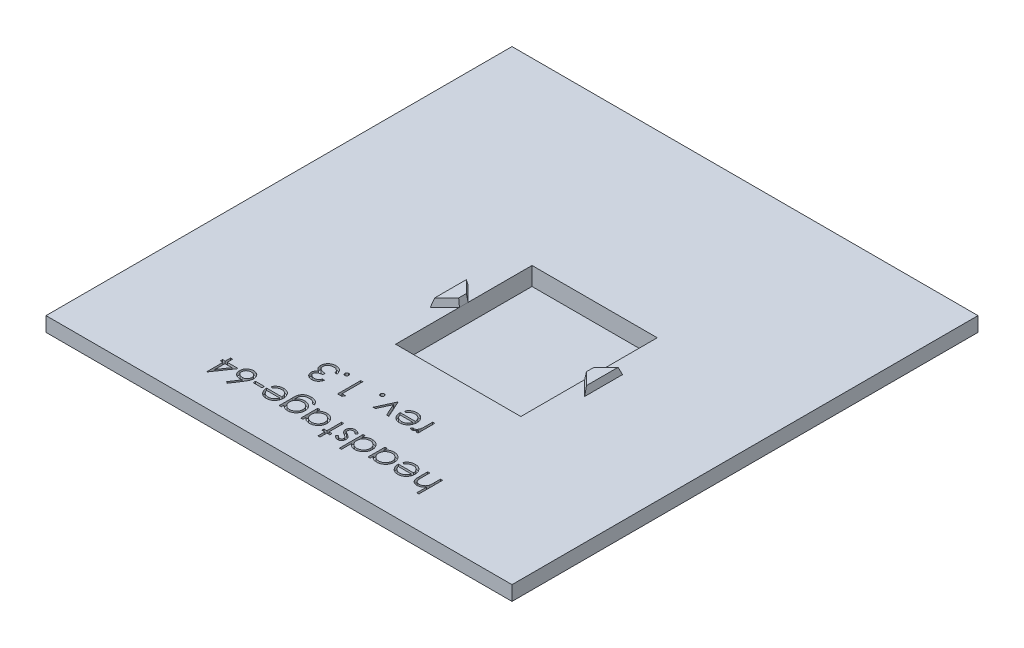
from build123d import *

# Parameters (mm, degrees)
SKETCH1_W           = 64
SKETCH1_H           = 64
BOSS_EXTRUDE1_DEPTH = 4
SKETCH2_W           = 64
SKETCH2_H           = 64
SKETCH2_W_2         = 60
SKETCH2_H_2         = 60
CUT_EXTRUDE1_DEPTH  = 2
SKETCH7_W           = 17.2
SKETCH7_H           = 18.735020646
CUT_EXTRUDE2_DEPTH  = 2.5
BOSS_EXTRUDE2_DEPTH = 1
BOSS_EXTRUDE2_TAPER = 10
SKETCH9_W           = 1.221153846
SKETCH9_H           = 0.325641025
CUT_EXTRUDE3_DEPTH  = 0.5


with BuildPart() as part:
    # Sketch1 → Boss-Extrude1 (new body)
    with BuildSketch(Plane(origin=(0, 0, 0), x_dir=(1, 0, 0), z_dir=(0, 1, 0))):
        Rectangle(SKETCH1_W, SKETCH1_H)
    extrude(amount=BOSS_EXTRUDE1_DEPTH)

    # Sketch2 → Cut-Extrude1 (cut)
    with BuildSketch(Plane.XZ):
        Rectangle(SKETCH2_W, SKETCH2_H)
        Rectangle(SKETCH2_W_2, SKETCH2_H_2, mode=Mode.SUBTRACT)
    extrude(amount=-CUT_EXTRUDE1_DEPTH, mode=Mode.SUBTRACT)

    # Sketch7 → Cut-Extrude2 (cut)
    with BuildSketch(Plane(origin=(0, 4, 0), x_dir=(1, 0, 0), z_dir=(0, 1, 0))):
        with Locations((4.01, -2.03)):
            Rectangle(SKETCH7_W, SKETCH7_H)
    extrude(amount=-CUT_EXTRUDE2_DEPTH, mode=Mode.SUBTRACT)

    # Sketch8 → Boss-Extrude2 (add)
    with BuildSketch(Plane(origin=(0, 4, 0), x_dir=(1, 0, 0), z_dir=(0, 1, 0))):
        Polygon((12.61, -2.63), (14.61, -4.63), (14.61, -0.3573502), (14.61, 0.57), (12.61, -1.43), align=None)
    boss_extrude2 = extrude(amount=BOSS_EXTRUDE2_DEPTH, taper=BOSS_EXTRUDE2_TAPER)

    # Mirror1: Boss-Extrude2 across plane
    add(boss_extrude2.mirror(Plane.ZY.offset(-4.01)))

    # Sketch9 → Cut-Extrude3 (cut)
    # profile 1 of 19: a face of its own
    with BuildSketch(Plane(origin=(0, 4, 0), x_dir=(1, 0, 0), z_dir=(0, 1, 0))):
        with BuildLine():
            Line((14.822247553, -27.624995653), (14.537311655, -27.624995653))
            Line((14.537311655, -27.624995653), (14.537311655, -26.250561558))
            add(Edge.make_bspline(
                [(14.537311655, -26.250561558), (14.506676544, -26.288739011), (14.44712306, -26.36295452), (14.347567876, -26.460834433), (14.243830646, -26.544204841), (14.135031019, -26.612284773), (14.021631398, -26.665098263), (13.903353129, -26.702046884), (13.780497758, -26.725087223), (13.696808839, -26.728007273), (13.654519187, -26.729482832)],
                knots=[0, 0, 0, 0, 1.12556596, 2.18805719, 3.205172764, 4.182516927, 5.13416184, 6.075333115, 7.027428072, 8, 8, 8, 8], degree=3))
            add(Edge.make_bspline(
                [(13.654519187, -26.729482832), (13.611563051, -26.727989122), (13.527445386, -26.725064105), (13.405411263, -26.699290999), (13.290637528, -26.658504613), (13.18465733, -26.601182358), (13.089107141, -26.530009525), (13.006232807, -26.446536052), (12.936710419, -26.351861361), (12.890194791, -26.263613496), (12.859708361, -26.185135621), (12.840437094, -26.117786596), (12.824088915, -26.042747807), (12.809847684, -25.960047817), (12.800355516, -25.869292723), (12.792731388, -25.770891028), (12.787309872, -25.664848657), (12.787099777, -25.591442429), (12.786991142, -25.553486238)],
                knots=[0, 0, 0, 0, 1.235689485, 2.419754739, 3.574485241, 4.732583367, 5.875375667, 6.993392835, 8.106934443, 9.24564317, 9.854426656, 10.528623913, 11.260290605, 12.06517837, 12.94359002, 13.886555271, 14.907200199, 16, 16, 16, 16], degree=3))
            Line((12.786991142, -25.553486238), (12.786991142, -24.368585396))
            Line((12.786991142, -24.368585396), (13.07192704, -24.368585396))
            Line((13.07192704, -24.368585396), (13.07192704, -25.459991646))
            add(Edge.make_bspline(
                [(13.07192704, -25.459991646), (13.072098982, -25.491580823), (13.072427878, -25.552005541), (13.07352844, -25.638515698), (13.075929364, -25.716770156), (13.079952578, -25.786931358), (13.084000873, -25.848904221), (13.089740299, -25.902789971), (13.096368147, -25.948250566), (13.102327354, -25.975614167), (13.104999957, -25.987886278)],
                knots=[0, 0, 0, 0, 1.430934443, 2.737134061, 3.918973087, 4.976914145, 5.92044225, 6.731742364, 7.431207999, 8, 8, 8, 8], degree=3))
            add(Edge.make_bspline(
                [(13.104999957, -25.987886278), (13.115315266, -26.023921079), (13.135093996, -26.093014755), (13.181984392, -26.186701193), (13.239187331, -26.267303163), (13.31008976, -26.332531324), (13.392336276, -26.383927116), (13.486707699, -26.418943096), (13.591998135, -26.441273169), (13.666055978, -26.44342317), (13.70476458, -26.444546935)],
                knots=[0, 0, 0, 0, 1.090171874, 2.090312098, 3.036871164, 3.954896932, 4.878889889, 5.844924892, 6.87358393, 8, 8, 8, 8], degree=3))
            add(Edge.make_bspline(
                [(13.70476458, -26.444546935), (13.727688098, -26.444121505), (13.773053147, -26.443279592), (13.840286865, -26.434612959), (13.905709237, -26.420925181), (13.969144674, -26.400707114), (14.030722573, -26.376125768), (14.090693243, -26.345959538), (14.148235949, -26.30948532), (14.2040934, -26.268433949), (14.256091194, -26.223020282), (14.304465832, -26.175078795), (14.347590074, -26.124029821), (14.386659392, -26.070689595), (14.420385421, -26.014327214), (14.449824999, -25.955486003), (14.47480381, -25.89408863), (14.487215966, -25.851475538), (14.493426439, -25.830153906)],
                knots=[0, 0, 0, 0, 1.024369801, 2.02720137, 3.025498567, 4.008789058, 4.999724648, 5.987391013, 7.005161842, 8.042127274, 9.083588116, 10.088924978, 11.084112559, 12.068088063, 13.041783903, 14.016724555, 15.007660144, 16, 16, 16, 16], degree=3))
            add(Edge.make_bspline(
                [(14.493426439, -25.830153906), (14.497000062, -25.814713472), (14.504787427, -25.781066866), (14.513237312, -25.725573015), (14.520800884, -25.66108752), (14.527194926, -25.58770819), (14.531116583, -25.505166134), (14.535342273, -25.414024621), (14.536915271, -25.313712745), (14.537175578, -25.243957535), (14.537311655, -25.207492648)],
                knots=[0, 0, 0, 0, 0.607992626, 1.324890765, 2.152360218, 3.099583803, 4.150613268, 5.323148443, 6.60066238, 8, 8, 8, 8], degree=3))
            Line((14.537311655, -25.207492648), (14.537311655, -24.368585396))
            Line((14.537311655, -24.368585396), (14.822247553, -24.368585396))
            Line((14.822247553, -24.368585396), (14.822247553, -27.624995653))
        make_face()
    # profile 2 of 19: a face of its own
    with BuildSketch(Plane(origin=(0, 4, 0), x_dir=(1, 0, 0), z_dir=(0, 1, 0))):
        with BuildLine():
            Line((10.231472312, -25.101277704), (9.978337296, -24.96835002))
            add(Edge.make_bspline(
                [(9.978337296, -24.96835002), (9.998522554, -24.932580696), (10.037795072, -24.862987757), (10.105007876, -24.767321921), (10.176196996, -24.682066834), (10.252777164, -24.607622726), (10.333787703, -24.542240783), (10.420435026, -24.486218096), (10.511277375, -24.437577226), (10.607632392, -24.397932263), (10.709408141, -24.366727354), (10.817231622, -24.343692347), (10.931601784, -24.330331846), (11.009922718, -24.328710486), (11.050027, -24.327880268)],
                knots=[0, 0, 0, 0, 1.120547187, 2.180141081, 3.186367408, 4.148075574, 5.090720713, 6.023293347, 6.960451315, 7.899733127, 8.862572377, 9.862522039, 10.90550313, 12, 12, 12, 12], degree=3))
            add(Edge.make_bspline(
                [(11.050027, -24.327880268), (11.094605793, -24.32892092), (11.181566105, -24.330950931), (11.308148594, -24.34845195), (11.427328481, -24.377001881), (11.539099147, -24.416884889), (11.643186586, -24.468979746), (11.739798728, -24.532442727), (11.829439684, -24.606949415), (11.909299597, -24.693139106), (11.981150315, -24.785393254), (12.044708825, -24.88145946), (12.097230307, -24.981297215), (12.142059471, -25.08339072), (12.175229072, -25.189098743), (12.19999326, -25.297489943), (12.21386876, -25.408961248), (12.216030142, -25.484336717), (12.217119348, -25.522321374)],
                knots=[0, 0, 0, 0, 1.145213001, 2.233978795, 3.276616913, 4.289988888, 5.2768102, 6.260573508, 7.254647871, 8.264498533, 9.273731702, 10.25749501, 11.220258744, 12.169609138, 13.119022067, 14.062790212, 15.023763961, 16, 16, 16, 16], degree=3))
            add(Edge.make_bspline(
                [(12.217119348, -25.522321374), (12.216158555, -25.557967398), (12.214254391, -25.628613112), (12.202252177, -25.733175428), (12.180981225, -25.834801238), (12.151792703, -25.933574987), (12.114099787, -26.029331295), (12.067987702, -26.122128438), (12.013384617, -26.211867672), (11.971227263, -26.268476229), (11.949991944, -26.296990845)],
                knots=[0, 0, 0, 0, 1.024358464, 2.0301432, 3.019427413, 4.004406732, 4.986367066, 5.972626655, 6.978780325, 8, 8, 8, 8], degree=3))
            add(Edge.make_bspline(
                [(11.949991944, -26.296990845), (11.921278133, -26.331400278), (11.864852327, -26.399018613), (11.76842598, -26.487056668), (11.665420108, -26.562365697), (11.554798595, -26.623802952), (11.436747778, -26.671057915), (11.311876554, -26.704669745), (11.179839781, -26.725584561), (11.089327129, -26.728163653), (11.043030806, -26.729482832)],
                knots=[0, 0, 0, 0, 1.030811313, 2.025658015, 2.997072178, 3.962767568, 4.930766827, 5.917075773, 6.934604948, 8, 8, 8, 8], degree=3))
            add(Edge.make_bspline(
                [(11.043030806, -26.729482832), (10.9954506, -26.728260668), (10.902109081, -26.725863061), (10.766047168, -26.703436538), (10.637049724, -26.668304042), (10.516181301, -26.617117663), (10.401579493, -26.55366865), (10.295881849, -26.473472069), (10.196186899, -26.38064691), (10.138218761, -26.309186), (10.10872091, -26.272822175)],
                knots=[0, 0, 0, 0, 1.056389096, 2.072394598, 3.055233004, 4.020130009, 4.981825462, 5.957811105, 6.960805292, 8, 8, 8, 8], degree=3))
            add(Edge.make_bspline(
                [(10.10872091, -26.272822175), (10.088648616, -26.245423212), (10.048637635, -26.190807661), (9.998520623, -26.101752397), (9.955016415, -26.008579215), (9.920242943, -25.909782017), (9.892085681, -25.806531398), (9.871714138, -25.698089233), (9.859767413, -25.584487813), (9.857419095, -25.507084438), (9.856221912, -25.467623858)],
                knots=[0, 0, 0, 0, 0.94817472, 1.890038105, 2.849395472, 3.817997239, 4.812318967, 5.836947057, 6.897266129, 8, 8, 8, 8], degree=3))
            Line((9.856221912, -25.467623858), (11.93218345, -25.467623858))
            add(Edge.make_bspline(
                [(11.93218345, -25.467623858), (11.930785481, -25.437053341), (11.928036431, -25.376937652), (11.915250831, -25.28896251), (11.894999703, -25.20519854), (11.866850047, -25.126002639), (11.831553284, -25.05111478), (11.789674677, -24.980018847), (11.73940707, -24.913794564), (11.683432188, -24.851583749), (11.621096503, -24.796203183), (11.555540368, -24.746596582), (11.485903343, -24.705249339), (11.41288743, -24.671182391), (11.336113965, -24.644962186), (11.255690911, -24.626906062), (11.171868449, -24.614843662), (11.114731966, -24.613500145), (11.085643987, -24.612816165)],
                knots=[0, 0, 0, 0, 1.094405546, 2.152104367, 3.174987145, 4.173015398, 5.153654967, 6.133208507, 7.119289451, 8.123438607, 9.122504012, 10.097966803, 11.060604936, 12.014205423, 12.976096155, 13.956823727, 14.959826266, 16, 16, 16, 16], degree=3))
            add(Edge.make_bspline(
                [(11.085643987, -24.612816165), (11.057202051, -24.613359478), (11.000767794, -24.614437515), (10.916552002, -24.625228455), (10.83350664, -24.642047219), (10.752708553, -24.666451145), (10.675451694, -24.695312383), (10.603304607, -24.729057949), (10.536944766, -24.767093402), (10.475040999, -24.810990012), (10.41532355, -24.864304184), (10.355894259, -24.930960662), (10.292741946, -25.010264935), (10.252664068, -25.069798482), (10.231472312, -25.101277704)],
                knots=[0, 0, 0, 0, 0.991026944, 1.966387566, 2.954903586, 3.941705208, 4.905318989, 5.827751054, 6.715113263, 7.568237245, 8.468614997, 9.499196909, 10.677664282, 12, 12, 12, 12], degree=3))
        make_face()
        with BuildLine():
            add(Edge.make_bspline(
                [(10.141157809, -25.752559755), (10.151526934, -25.790381846), (10.171432286, -25.862987973), (10.214091992, -25.963259595), (10.259907779, -26.053400385), (10.31617083, -26.131130976), (10.379843405, -26.199798205), (10.453617012, -26.259444206), (10.535054399, -26.314155005), (10.625636094, -26.359763289), (10.721861163, -26.397229141), (10.821731779, -26.424781447), (10.924416905, -26.440976763), (10.993577632, -26.443351283), (11.0284024, -26.444546935)],
                knots=[0, 0, 0, 0, 1.154958961, 2.217145986, 3.207012531, 4.129872728, 5.036522214, 5.960144231, 6.920619777, 7.92424629, 8.943461387, 9.961007416, 10.973298156, 12, 12, 12, 12], degree=3))
            add(Edge.make_bspline(
                [(11.0284024, -26.444546935), (11.056842188, -26.443996159), (11.113061668, -26.442907391), (11.195865013, -26.432443142), (11.275735681, -26.415405254), (11.352290774, -26.391027789), (11.425703216, -26.360374603), (11.496309832, -26.323483727), (11.563260767, -26.278597114), (11.605114577, -26.244336995), (11.626258971, -26.227028906)],
                knots=[0, 0, 0, 0, 1.04879286, 2.073242986, 3.073461291, 4.057960153, 5.032623303, 6.005244481, 6.992256684, 8, 8, 8, 8], degree=3))
            add(Edge.make_bspline(
                [(11.626258971, -26.227028906), (11.641404536, -26.213337644), (11.672055468, -26.185629868), (11.712967327, -26.137865197), (11.752431117, -26.086329913), (11.787500444, -26.028774454), (11.820828633, -25.966867866), (11.851199255, -25.900158431), (11.878813631, -25.828364568), (11.894315253, -25.778311408), (11.902290622, -25.752559755)],
                knots=[0, 0, 0, 0, 0.879905587, 1.780714457, 2.708106151, 3.677566983, 4.684151534, 5.740052498, 6.837288539, 8, 8, 8, 8], degree=3))
            Line((11.902290622, -25.752559755), (10.141157809, -25.752559755))
        make_face(mode=Mode.SUBTRACT)
    # profile 3 of 19: a face of its own
    with BuildSketch(Plane(origin=(0, 4, 0), x_dir=(1, 0, 0), z_dir=(0, 1, 0))):
        with BuildLine():
            Line((6.925452681, -26.688777704), (6.925452681, -24.368585396))
            Line((6.925452681, -24.368585396), (7.210388578, -24.368585396))
            Line((7.210388578, -24.368585396), (7.210388578, -24.76991252))
            add(Edge.make_bspline(
                [(7.210388578, -24.76991252), (7.24256201, -24.733640968), (7.305442238, -24.662751315), (7.409458045, -24.569568556), (7.520625626, -24.493489419), (7.637051034, -24.431735835), (7.759635439, -24.385184815), (7.88765891, -24.352390198), (8.021021278, -24.331056834), (8.111967185, -24.328948623), (8.158054844, -24.327880268)],
                knots=[0, 0, 0, 0, 1.074235403, 2.099501444, 3.086304576, 4.053325556, 5.01427503, 5.985443889, 6.979105517, 8, 8, 8, 8], degree=3))
            add(Edge.make_bspline(
                [(8.158054844, -24.327880268), (8.199028742, -24.328992578), (8.279831084, -24.331186103), (8.398691574, -24.348208848), (8.513081169, -24.375531824), (8.623072772, -24.413577993), (8.7279211, -24.463784523), (8.828216944, -24.524541359), (8.924194379, -24.596184401), (9.014028113, -24.678406592), (9.096857042, -24.76761713), (9.169323988, -24.863045328), (9.230742085, -24.963380483), (9.281216761, -25.068594396), (9.320276712, -25.178610153), (9.347451869, -25.293352283), (9.364456269, -25.412629861), (9.366648683, -25.493855346), (9.367760373, -25.535041726)],
                knots=[0, 0, 0, 0, 1.034036272, 2.039165313, 3.024406509, 3.999331371, 4.971254918, 5.953351348, 6.95522652, 7.989525907, 9.023492927, 10.024309745, 11.009187477, 11.988246066, 12.964946762, 13.950187958, 14.960617622, 16, 16, 16, 16], degree=3))
            add(Edge.make_bspline(
                [(9.367760373, -25.535041726), (9.366624026, -25.575376829), (9.364377529, -25.655117152), (9.347633821, -25.772388915), (9.319499034, -25.885353938), (9.279940195, -25.993593757), (9.229438679, -26.097544289), (9.16696433, -26.196392224), (9.094523496, -26.291649656), (9.010809336, -26.380261849), (8.920169311, -26.461816961), (8.823654893, -26.53363411), (8.722469519, -26.59423517), (8.616410298, -26.643497941), (8.506228223, -26.682645138), (8.391086301, -26.709934503), (8.27150815, -26.725976281), (8.190328342, -26.728302751), (8.149150598, -26.729482832)],
                knots=[0, 0, 0, 0, 1.02050356, 2.017480486, 2.990790918, 3.96161403, 4.928589988, 5.909588639, 6.91611943, 7.952353252, 8.989586576, 9.99823133, 10.991940466, 11.968822692, 12.952985106, 13.945868367, 14.958059758, 16, 16, 16, 16], degree=3))
            add(Edge.make_bspline(
                [(8.149150598, -26.729482832), (8.101796923, -26.728183483), (8.008938603, -26.725635521), (7.872924861, -26.704250416), (7.744195058, -26.668456301), (7.621634193, -26.619601023), (7.506964644, -26.553810349), (7.399084045, -26.472405197), (7.299272439, -26.373412039), (7.240529056, -26.298104922), (7.210388578, -26.259465805)],
                knots=[0, 0, 0, 0, 1.038908319, 2.037250181, 3.012632028, 3.966567879, 4.9252131, 5.905168122, 6.925168603, 8, 8, 8, 8], degree=3))
            Line((7.210388578, -26.259465805), (7.210388578, -26.688777704))
            Line((7.210388578, -26.688777704), (6.925452681, -26.688777704))
        make_face()
        with BuildLine():
            add(Edge.make_bspline(
                [(8.145334492, -26.444546935), (8.186984484, -26.44306374), (8.269194944, -26.440136148), (8.389897461, -26.417318302), (8.505341567, -26.379254938), (8.615339529, -26.327498871), (8.716854502, -26.261200947), (8.809085576, -26.183030552), (8.889532524, -26.092029952), (8.957552682, -25.9902899), (9.01402202, -25.881873514), (9.052990248, -25.767714344), (9.078873122, -25.650897883), (9.081503928, -25.5716437), (9.082824476, -25.531861638)],
                knots=[0, 0, 0, 0, 1.031179624, 2.035384561, 3.030098214, 4.035455833, 5.037557836, 6.024646278, 7.02156144, 8.035264006, 9.049836703, 10.039645228, 11.015989397, 12, 12, 12, 12], degree=3))
            add(Edge.make_bspline(
                [(9.082824476, -25.531861638), (9.081110243, -25.492327041), (9.077688495, -25.413412808), (9.053785408, -25.296417329), (9.011828562, -25.183002958), (8.956594468, -25.073189034), (8.887503585, -24.970690111), (8.807215415, -24.878009233), (8.714516343, -24.798633845), (8.612107468, -24.732148534), (8.50284538, -24.678666443), (8.387902483, -24.640945354), (8.269282197, -24.617128589), (8.188482564, -24.614258475), (8.147878562, -24.612816165)],
                knots=[0, 0, 0, 0, 0.979235476, 1.954632679, 2.943119654, 3.967171814, 4.992637064, 5.997548408, 6.995574264, 8.005058949, 9.015076297, 9.999929117, 10.994910263, 12, 12, 12, 12], degree=3))
            add(Edge.make_bspline(
                [(8.147878562, -24.612816165), (8.106652748, -24.614316738), (8.024867227, -24.617293638), (7.903747356, -24.640268847), (7.786424408, -24.67880484), (7.673853846, -24.73127948), (7.569162994, -24.796335271), (7.475638608, -24.872835062), (7.394842534, -24.960441621), (7.328320283, -25.058631476), (7.275169903, -25.165089586), (7.237535402, -25.278797184), (7.214677531, -25.399078579), (7.211837997, -25.481514576), (7.210388578, -25.523593409)],
                knots=[0, 0, 0, 0, 1.017730373, 2.019016736, 3.032373701, 4.060729657, 5.079187105, 6.068726676, 7.03591854, 8.011858086, 8.988317194, 9.965225429, 10.961364673, 12, 12, 12, 12], degree=3))
            add(Edge.make_bspline(
                [(7.210388578, -25.523593409), (7.211259138, -25.555649857), (7.212972674, -25.618747092), (7.226063065, -25.711391517), (7.246887182, -25.800049321), (7.27622716, -25.884817544), (7.314782564, -25.965213408), (7.361234905, -26.041867106), (7.41653699, -26.114064619), (7.479005835, -26.181714515), (7.548154641, -26.243109348), (7.621685434, -26.297222239), (7.699413212, -26.343016635), (7.781283414, -26.37966413), (7.86666547, -26.409519925), (7.956377751, -26.429239162), (8.049516121, -26.442822672), (8.113058746, -26.443966129), (8.145334492, -26.444546935)],
                knots=[0, 0, 0, 0, 1.050062701, 2.066855696, 3.059271411, 4.030305351, 4.999747758, 5.975466543, 6.961907836, 7.974539719, 8.98812422, 9.98710676, 10.961662635, 11.93785114, 12.922015094, 13.919620009, 14.94329489, 16, 16, 16, 16], degree=3))
        make_face(mode=Mode.SUBTRACT)
    # profile 4 of 19: a face of its own
    with BuildSketch(Plane(origin=(0, 4, 0), x_dir=(1, 0, 0), z_dir=(0, 1, 0))):
        with BuildLine():
            Line((3.913273194, -27.624995653), (3.913273194, -24.368585396))
            Line((3.913273194, -24.368585396), (4.198209091, -24.368585396))
            Line((4.198209091, -24.368585396), (4.198209091, -24.76991252))
            add(Edge.make_bspline(
                [(4.198209091, -24.76991252), (4.230382523, -24.733640968), (4.29326275, -24.662751315), (4.397278558, -24.569568556), (4.508446139, -24.493489419), (4.624871546, -24.431735835), (4.747455952, -24.385184815), (4.875479423, -24.352390198), (5.008841791, -24.331056834), (5.099787698, -24.328948623), (5.145875357, -24.327880268)],
                knots=[0, 0, 0, 0, 1.074235403, 2.099501444, 3.086304576, 4.053325556, 5.01427503, 5.985443889, 6.979105517, 8, 8, 8, 8], degree=3))
            add(Edge.make_bspline(
                [(5.145875357, -24.327880268), (5.186849255, -24.328992578), (5.267651596, -24.331186103), (5.386512087, -24.348208848), (5.500901682, -24.375531824), (5.610893285, -24.413577993), (5.715741613, -24.463784523), (5.816037457, -24.524541359), (5.912014892, -24.596184401), (6.001848626, -24.678406592), (6.084677554, -24.76761713), (6.157144501, -24.863045328), (6.218562598, -24.963380483), (6.269037274, -25.068594396), (6.308097225, -25.178610153), (6.335272382, -25.293352283), (6.352276782, -25.412629861), (6.354469196, -25.493855346), (6.355580886, -25.535041726)],
                knots=[0, 0, 0, 0, 1.034036272, 2.039165313, 3.024406509, 3.999331371, 4.971254918, 5.953351348, 6.95522652, 7.989525907, 9.023492927, 10.024309745, 11.009187477, 11.988246066, 12.964946762, 13.950187958, 14.960617622, 16, 16, 16, 16], degree=3))
            add(Edge.make_bspline(
                [(6.355580886, -25.535041726), (6.354444539, -25.575376829), (6.352198042, -25.655117152), (6.335454334, -25.772388915), (6.307319547, -25.885353938), (6.267760708, -25.993593757), (6.217259192, -26.097544289), (6.154784842, -26.196392224), (6.082344009, -26.291649656), (5.998629849, -26.380261849), (5.907989824, -26.461816961), (5.811475405, -26.53363411), (5.710290031, -26.59423517), (5.604230811, -26.643497941), (5.494048736, -26.682645138), (5.378906814, -26.709934503), (5.259328663, -26.725976281), (5.178148855, -26.728302751), (5.13697111, -26.729482832)],
                knots=[0, 0, 0, 0, 1.02050356, 2.017480486, 2.990790918, 3.96161403, 4.928589988, 5.909588639, 6.91611943, 7.952353252, 8.989586576, 9.99823133, 10.991940466, 11.968822692, 12.952985106, 13.945868367, 14.958059758, 16, 16, 16, 16], degree=3))
            add(Edge.make_bspline(
                [(5.13697111, -26.729482832), (5.089595824, -26.728086009), (4.996603401, -26.725344202), (4.860585535, -26.701648982), (4.731458658, -26.663721043), (4.60922773, -26.609846323), (4.494965646, -26.539634711), (4.387144963, -26.455197769), (4.287417731, -26.35441273), (4.228398672, -26.278553147), (4.198209091, -26.239749258)],
                knots=[0, 0, 0, 0, 1.03083325, 2.023411113, 2.996083796, 3.9549903, 4.922369457, 5.908572979, 6.930187902, 8, 8, 8, 8], degree=3))
            Line((4.198209091, -26.239749258), (4.198209091, -27.624995653))
            Line((4.198209091, -27.624995653), (3.913273194, -27.624995653))
        make_face()
        with BuildLine():
            add(Edge.make_bspline(
                [(5.133155005, -26.444546935), (5.174804997, -26.44306374), (5.257015457, -26.440136148), (5.377717974, -26.417318302), (5.493162079, -26.379254938), (5.603160041, -26.327498871), (5.704675015, -26.261200947), (5.796906089, -26.183030552), (5.877353037, -26.092029952), (5.945373195, -25.9902899), (6.001842532, -25.881873514), (6.040810761, -25.767714344), (6.066693635, -25.650897883), (6.069324441, -25.5716437), (6.070644989, -25.531861638)],
                knots=[0, 0, 0, 0, 1.031179624, 2.035384561, 3.030098214, 4.035455833, 5.037557836, 6.024646278, 7.02156144, 8.035264006, 9.049836703, 10.039645228, 11.015989397, 12, 12, 12, 12], degree=3))
            add(Edge.make_bspline(
                [(6.070644989, -25.531861638), (6.068930755, -25.492327041), (6.065509008, -25.413412808), (6.041605921, -25.296417329), (5.999649075, -25.183002958), (5.94441498, -25.073189034), (5.875324097, -24.970690111), (5.795035928, -24.878009233), (5.702336855, -24.798633845), (5.599927981, -24.732148534), (5.490665892, -24.678666443), (5.375722996, -24.640945354), (5.25710271, -24.617128589), (5.176303077, -24.614258475), (5.135699075, -24.612816165)],
                knots=[0, 0, 0, 0, 0.979235476, 1.954632679, 2.943119654, 3.967171814, 4.992637064, 5.997548408, 6.995574264, 8.005058949, 9.015076297, 9.999929117, 10.994910263, 12, 12, 12, 12], degree=3))
            add(Edge.make_bspline(
                [(5.135699075, -24.612816165), (5.094473261, -24.614316738), (5.01268774, -24.617293638), (4.891567869, -24.640268847), (4.774244921, -24.67880484), (4.661674359, -24.73127948), (4.556983507, -24.796335271), (4.463459121, -24.872835062), (4.382663047, -24.960441621), (4.316140796, -25.058631476), (4.262990415, -25.165089586), (4.225355914, -25.278797184), (4.202498044, -25.399078579), (4.19965851, -25.481514576), (4.198209091, -25.523593409)],
                knots=[0, 0, 0, 0, 1.017730373, 2.019016736, 3.032373701, 4.060729657, 5.079187105, 6.068726676, 7.03591854, 8.011858086, 8.988317194, 9.965225429, 10.961364673, 12, 12, 12, 12], degree=3))
            add(Edge.make_bspline(
                [(4.198209091, -25.523593409), (4.19907965, -25.555649857), (4.200793186, -25.618747092), (4.213883578, -25.711391517), (4.234707695, -25.800049321), (4.264047673, -25.884817544), (4.302603077, -25.965213408), (4.349055418, -26.041867106), (4.404357503, -26.114064619), (4.466826347, -26.181714515), (4.535975154, -26.243109348), (4.609505947, -26.297222239), (4.687233725, -26.343016635), (4.769103927, -26.37966413), (4.854485983, -26.409519925), (4.944198264, -26.429239162), (5.037336634, -26.442822672), (5.100879259, -26.443966129), (5.133155005, -26.444546935)],
                knots=[0, 0, 0, 0, 1.050062701, 2.066855696, 3.059271411, 4.030305351, 4.999747758, 5.975466543, 6.961907836, 7.974539719, 8.98812422, 9.98710676, 10.961662635, 11.93785114, 12.922015094, 13.919620009, 14.94329489, 16, 16, 16, 16], degree=3))
        make_face(mode=Mode.SUBTRACT)
    # profile 5 of 19: a face of its own
    with BuildSketch(Plane(origin=(0, 4, 0), x_dir=(1, 0, 0), z_dir=(0, 1, 0))):
        with BuildLine():
            Line((2.162952681, -26.399389683), (2.35630204, -26.200316165))
            add(Edge.make_bspline(
                [(2.35630204, -26.200316165), (2.372982117, -26.219654414), (2.405139341, -26.25693628), (2.456185846, -26.306716277), (2.507018285, -26.348869421), (2.557368556, -26.383554245), (2.60733062, -26.410851521), (2.657331057, -26.4301313), (2.707232659, -26.442235076), (2.740605526, -26.44378557), (2.756993146, -26.444546935)],
                knots=[0, 0, 0, 0, 1.265880991, 2.440469525, 3.530740057, 4.536711111, 5.468008477, 6.34654737, 7.188078389, 8, 8, 8, 8], degree=3))
            add(Edge.make_bspline(
                [(2.756993146, -26.444546935), (2.777068941, -26.443559823), (2.816575266, -26.441617327), (2.873140711, -26.422698035), (2.92501113, -26.392830577), (2.970915256, -26.352107116), (3.009241455, -26.303848208), (3.037967768, -26.250342817), (3.055157672, -26.192449178), (3.057352373, -26.152515979), (3.058465501, -26.132262279)],
                knots=[0, 0, 0, 0, 0.999905305, 1.967672129, 2.944835807, 3.972828834, 5.013019963, 6.007753697, 6.989553527, 8, 8, 8, 8], degree=3))
            add(Edge.make_bspline(
                [(3.058465501, -26.132262279), (3.057457836, -26.113927068), (3.055445346, -26.077308331), (3.039800144, -26.023289758), (3.014884493, -25.97062373), (2.991597959, -25.938363094), (2.979599316, -25.921740444)],
                knots=[0, 0, 0, 0, 0.960159726, 1.917612774, 2.927026955, 4, 4, 4, 4], degree=3))
            add(Edge.make_bspline(
                [(2.979599316, -25.921740444), (2.972338129, -25.912903743), (2.95679003, -25.893982057), (2.92858858, -25.867053921), (2.895181097, -25.83889686), (2.856250409, -25.8097019), (2.811718264, -25.779438458), (2.762237279, -25.747592449), (2.707195905, -25.715096084), (2.668432653, -25.69373074), (2.648234131, -25.682597816)],
                knots=[0, 0, 0, 0, 0.667332049, 1.428932371, 2.272176193, 3.217953793, 4.268659351, 5.415594948, 6.6533338, 8, 8, 8, 8], degree=3))
            add(Edge.make_bspline(
                [(2.648234131, -25.682597816), (2.623543111, -25.668774327), (2.57584819, -25.642071897), (2.50815064, -25.600528405), (2.446348535, -25.559514699), (2.3912952, -25.518093049), (2.341699743, -25.477967316), (2.298359113, -25.438028245), (2.261139075, -25.398170274), (2.240321146, -25.370285304), (2.23037055, -25.35695679)],
                knots=[0, 0, 0, 0, 1.271974443, 2.457035787, 3.569878245, 4.604907449, 5.553098313, 6.436573686, 7.252710343, 8, 8, 8, 8], degree=3))
            add(Edge.make_bspline(
                [(2.23037055, -25.35695679), (2.213743766, -25.330083283), (2.18058973, -25.276497136), (2.147704278, -25.187766412), (2.126088297, -25.094684289), (2.123544377, -25.030806229), (2.122247553, -24.998242848)],
                knots=[0, 0, 0, 0, 0.995678878, 1.985397446, 2.973007791, 4, 4, 4, 4], degree=3))
            add(Edge.make_bspline(
                [(2.122247553, -24.998242848), (2.122898828, -24.97531942), (2.124182236, -24.930146301), (2.133145651, -24.863631214), (2.148449991, -24.799972096), (2.169648625, -24.738784165), (2.196883724, -24.680232276), (2.23083367, -24.624731053), (2.270891413, -24.572291523), (2.315496736, -24.522226027), (2.365311766, -24.476736314), (2.419090087, -24.437345282), (2.475209352, -24.403076079), (2.534903137, -24.375824645), (2.59742145, -24.353923534), (2.66312026, -24.338826862), (2.731723234, -24.329775073), (2.778377847, -24.328519856), (2.802150397, -24.327880268)],
                knots=[0, 0, 0, 0, 1.032810722, 2.035266353, 3.017676364, 3.978389067, 4.948507077, 5.921677479, 6.903715858, 7.918386526, 8.939467451, 9.936812204, 10.918153393, 11.89693397, 12.887853058, 13.89815236, 14.929017384, 16, 16, 16, 16], degree=3))
            add(Edge.make_bspline(
                [(2.802150397, -24.327880268), (2.83423507, -24.32877671), (2.897958602, -24.330557139), (2.992177922, -24.347404971), (3.084438799, -24.373318019), (3.173415602, -24.410262906), (3.257749067, -24.455683257), (3.3353659, -24.509422908), (3.405458548, -24.571197793), (3.445497372, -24.618447915), (3.465516783, -24.642072976)],
                knots=[0, 0, 0, 0, 1.014105853, 2.01412079, 3.018242674, 4.040740662, 5.055023907, 6.042888753, 7.021444376, 8, 8, 8, 8], degree=3))
            Line((3.465516783, -24.642072976), (3.276619548, -24.857046935))
            add(Edge.make_bspline(
                [(3.276619548, -24.857046935), (3.258683145, -24.837675113), (3.223910715, -24.800119906), (3.168301754, -24.750114254), (3.111714726, -24.708203101), (3.054714689, -24.673148004), (2.996457889, -24.646137459), (2.937270796, -24.627161306), (2.877273797, -24.614965503), (2.836976574, -24.613533776), (2.816778803, -24.612816165)],
                knots=[0, 0, 0, 0, 1.179806542, 2.287233372, 3.337373186, 4.324005949, 5.273901747, 6.200048787, 7.097828587, 8, 8, 8, 8], degree=3))
            add(Edge.make_bspline(
                [(2.816778803, -24.612816165), (2.789276316, -24.61405981), (2.735541071, -24.616489683), (2.658572801, -24.638547202), (2.58751919, -24.673142351), (2.525771488, -24.722182669), (2.473517003, -24.779237461), (2.434916809, -24.843271279), (2.41152787, -24.913139464), (2.408644417, -24.961603236), (2.40718345, -24.986158513)],
                knots=[0, 0, 0, 0, 1.072236613, 2.094970478, 3.102399718, 4.141104368, 5.155589565, 6.110053346, 7.042415349, 8, 8, 8, 8], degree=3))
            add(Edge.make_bspline(
                [(2.40718345, -24.986158513), (2.40813845, -25.006405541), (2.410014268, -25.046174896), (2.425664506, -25.103872909), (2.449335375, -25.158917481), (2.473278274, -25.191153816), (2.485413618, -25.207492648)],
                knots=[0, 0, 0, 0, 1.014054094, 1.991812201, 2.982159616, 4, 4, 4, 4], degree=3))
            add(Edge.make_bspline(
                [(2.485413618, -25.207492648), (2.492689501, -25.21569126), (2.508539002, -25.233550797), (2.537648559, -25.259292343), (2.572225647, -25.287215392), (2.613806028, -25.315630736), (2.660291843, -25.34710933), (2.714165913, -25.378325947), (2.773340187, -25.412371964), (2.815232753, -25.434873163), (2.837131367, -25.446635276)],
                knots=[0, 0, 0, 0, 0.615029206, 1.339755737, 2.178261527, 3.109653826, 4.166232585, 5.329982127, 6.604294388, 8, 8, 8, 8], degree=3))
            add(Edge.make_bspline(
                [(2.837131367, -25.446635276), (2.86075939, -25.459824345), (2.906581668, -25.48540216), (2.971485282, -25.525240319), (3.030038954, -25.565759918), (3.083651618, -25.604687994), (3.130969101, -25.644076993), (3.171804997, -25.683970642), (3.207767057, -25.722760058), (3.227676495, -25.750244034), (3.237186455, -25.763372055)],
                knots=[0, 0, 0, 0, 1.262093308, 2.447601706, 3.550203992, 4.582594899, 5.537233252, 6.418365656, 7.244515135, 8, 8, 8, 8], degree=3))
            add(Edge.make_bspline(
                [(3.237186455, -25.763372055), (3.253609663, -25.78981955), (3.286357048, -25.842555065), (3.318718317, -25.930686259), (3.340348861, -26.02371913), (3.342370898, -26.088035886), (3.343401399, -26.120813962)],
                knots=[0, 0, 0, 0, 0.984940175, 1.963941237, 2.962352981, 4, 4, 4, 4], degree=3))
            add(Edge.make_bspline(
                [(3.343401399, -26.120813962), (3.34291738, -26.142245807), (3.341970087, -26.184190964), (3.334392776, -26.245817886), (3.320641151, -26.304384301), (3.303191734, -26.360884183), (3.27944681, -26.414278833), (3.250659736, -26.465123507), (3.216188037, -26.512594246), (3.177399571, -26.557016483), (3.135253758, -26.597812985), (3.089049375, -26.632710935), (3.040711802, -26.662975648), (2.989183663, -26.687214862), (2.935123116, -26.706478595), (2.878109064, -26.719526835), (2.818535752, -26.728303737), (2.777802782, -26.72908414), (2.756993146, -26.729482832)],
                knots=[0, 0, 0, 0, 1.087410352, 2.12821612, 3.143409386, 4.13688077, 5.124334423, 6.102425883, 7.096654197, 8.095527921, 9.09231389, 10.067027194, 11.028349958, 11.981147348, 12.950860869, 13.934615631, 14.944837612, 16, 16, 16, 16], degree=3))
            add(Edge.make_bspline(
                [(2.756993146, -26.729482832), (2.732324849, -26.728483382), (2.682525504, -26.726465735), (2.607836976, -26.710367563), (2.533343076, -26.684151318), (2.458967454, -26.647093044), (2.384393238, -26.600482374), (2.309954698, -26.543110992), (2.234442438, -26.476598339), (2.187315047, -26.425700943), (2.162952681, -26.399389683)],
                knots=[0, 0, 0, 0, 0.845753203, 1.707371858, 2.609134499, 3.549244224, 4.552329203, 5.621587647, 6.770486714, 8, 8, 8, 8], degree=3))
        make_face()
    # profile 6 of 19: a face of its own
    with BuildSketch(Plane(origin=(0, 4, 0), x_dir=(1, 0, 0), z_dir=(0, 1, 0))):
        Polygon((1.26743986, -27.624995653), (0.982503963, -27.624995653), (0.982503963, -26.688777704), (0.575452681, -26.688777704), (0.575452681, -26.403841806), (0.982503963, -26.403841806), (0.982503963, -24.368585396), (1.26743986, -24.368585396), (1.26743986, -26.403841806), (1.674491142, -26.403841806), (1.674491142, -26.688777704), (1.26743986, -26.688777704), align=None)
    # profile 7 of 19: a face of its own
    with BuildSketch(Plane(origin=(0, 4, 0), x_dir=(1, 0, 0), z_dir=(0, 1, 0))):
        with BuildLine():
            Line((-2.314611422, -26.688777704), (-2.314611422, -24.368585396))
            Line((-2.314611422, -24.368585396), (-2.029675524, -24.368585396))
            Line((-2.029675524, -24.368585396), (-2.029675524, -24.76991252))
            add(Edge.make_bspline(
                [(-2.029675524, -24.76991252), (-1.997502092, -24.733640968), (-1.934621865, -24.662751315), (-1.830606057, -24.569568556), (-1.719438476, -24.493489419), (-1.603013069, -24.431735835), (-1.480428664, -24.385184815), (-1.352405193, -24.352390198), (-1.219042824, -24.331056834), (-1.128096917, -24.328948623), (-1.082009258, -24.327880268)],
                knots=[0, 0, 0, 0, 1.074235403, 2.099501444, 3.086304576, 4.053325556, 5.01427503, 5.985443889, 6.979105517, 8, 8, 8, 8], degree=3))
            add(Edge.make_bspline(
                [(-1.082009258, -24.327880268), (-1.04103536, -24.328992578), (-0.960233019, -24.331186103), (-0.841372529, -24.348208848), (-0.726982933, -24.375531824), (-0.61699133, -24.413577993), (-0.512143003, -24.463784523), (-0.411847158, -24.524541359), (-0.315869724, -24.596184401), (-0.22603599, -24.678406592), (-0.143207061, -24.76761713), (-0.070740114, -24.863045328), (-0.009322017, -24.963380483), (0.041152659, -25.068594396), (0.080212609, -25.178610153), (0.107387766, -25.293352283), (0.124392167, -25.412629861), (0.12658458, -25.493855346), (0.127696271, -25.535041726)],
                knots=[0, 0, 0, 0, 1.034036272, 2.039165313, 3.024406509, 3.999331371, 4.971254918, 5.953351348, 6.95522652, 7.989525907, 9.023492927, 10.024309745, 11.009187477, 11.988246066, 12.964946762, 13.950187958, 14.960617622, 16, 16, 16, 16], degree=3))
            add(Edge.make_bspline(
                [(0.127696271, -25.535041726), (0.126559924, -25.575376829), (0.124313426, -25.655117152), (0.107569719, -25.772388915), (0.079434932, -25.885353938), (0.039876093, -25.993593757), (-0.010625424, -26.097544289), (-0.073099773, -26.196392224), (-0.145540606, -26.291649656), (-0.229254767, -26.380261849), (-0.319894791, -26.461816961), (-0.41640921, -26.53363411), (-0.517594584, -26.59423517), (-0.623653805, -26.643497941), (-0.733835879, -26.682645138), (-0.848977801, -26.709934503), (-0.968555953, -26.725976281), (-1.04973576, -26.728302751), (-1.090913505, -26.729482832)],
                knots=[0, 0, 0, 0, 1.02050356, 2.017480486, 2.990790918, 3.96161403, 4.928589988, 5.909588639, 6.91611943, 7.952353252, 8.989586576, 9.99823133, 10.991940466, 11.968822692, 12.952985106, 13.945868367, 14.958059758, 16, 16, 16, 16], degree=3))
            add(Edge.make_bspline(
                [(-1.090913505, -26.729482832), (-1.138267179, -26.728183483), (-1.231125499, -26.725635521), (-1.367139242, -26.704250416), (-1.495869045, -26.668456301), (-1.618429909, -26.619601023), (-1.733099458, -26.553810349), (-1.840980057, -26.472405197), (-1.940791664, -26.373412039), (-1.999535047, -26.298104922), (-2.029675524, -26.259465805)],
                knots=[0, 0, 0, 0, 1.038908319, 2.037250181, 3.012632028, 3.966567879, 4.9252131, 5.905168122, 6.925168603, 8, 8, 8, 8], degree=3))
            Line((-2.029675524, -26.259465805), (-2.029675524, -26.688777704))
            Line((-2.029675524, -26.688777704), (-2.314611422, -26.688777704))
        make_face()
        with BuildLine():
            add(Edge.make_bspline(
                [(-1.094729611, -26.444546935), (-1.053079618, -26.44306374), (-0.970869158, -26.440136148), (-0.850166642, -26.417318302), (-0.734722536, -26.379254938), (-0.624724574, -26.327498871), (-0.5232096, -26.261200947), (-0.430978527, -26.183030552), (-0.350531578, -26.092029952), (-0.28251142, -25.9902899), (-0.226042083, -25.881873514), (-0.187073854, -25.767714344), (-0.16119098, -25.650897883), (-0.158560174, -25.5716437), (-0.157239627, -25.531861638)],
                knots=[0, 0, 0, 0, 1.031179624, 2.035384561, 3.030098214, 4.035455833, 5.037557836, 6.024646278, 7.02156144, 8.035264006, 9.049836703, 10.039645228, 11.015989397, 12, 12, 12, 12], degree=3))
            add(Edge.make_bspline(
                [(-0.157239627, -25.531861638), (-0.15895386, -25.492327041), (-0.162375607, -25.413412808), (-0.186278694, -25.296417329), (-0.22823554, -25.183002958), (-0.283469635, -25.073189034), (-0.352560518, -24.970690111), (-0.432848687, -24.878009233), (-0.52554776, -24.798633845), (-0.627956635, -24.732148534), (-0.737218723, -24.678666443), (-0.852161619, -24.640945354), (-0.970781905, -24.617128589), (-1.051581538, -24.614258475), (-1.09218554, -24.612816165)],
                knots=[0, 0, 0, 0, 0.979235476, 1.954632679, 2.943119654, 3.967171814, 4.992637064, 5.997548408, 6.995574264, 8.005058949, 9.015076297, 9.999929117, 10.994910263, 12, 12, 12, 12], degree=3))
            add(Edge.make_bspline(
                [(-1.09218554, -24.612816165), (-1.133411354, -24.614316738), (-1.215196875, -24.617293638), (-1.336316746, -24.640268847), (-1.453639695, -24.67880484), (-1.566210257, -24.73127948), (-1.670901108, -24.796335271), (-1.764425494, -24.872835062), (-1.845221568, -24.960441621), (-1.91174382, -25.058631476), (-1.9648942, -25.165089586), (-2.002528701, -25.278797184), (-2.025386572, -25.399078579), (-2.028226106, -25.481514576), (-2.029675524, -25.523593409)],
                knots=[0, 0, 0, 0, 1.017730373, 2.019016736, 3.032373701, 4.060729657, 5.079187105, 6.068726676, 7.03591854, 8.011858086, 8.988317194, 9.965225429, 10.961364673, 12, 12, 12, 12], degree=3))
            add(Edge.make_bspline(
                [(-2.029675524, -25.523593409), (-2.028804965, -25.555649857), (-2.027091429, -25.618747092), (-2.014001038, -25.711391517), (-1.99317692, -25.800049321), (-1.963836942, -25.884817544), (-1.925281538, -25.965213408), (-1.878829197, -26.041867106), (-1.823527113, -26.114064619), (-1.761058268, -26.181714515), (-1.691909462, -26.243109348), (-1.618378668, -26.297222239), (-1.54065089, -26.343016635), (-1.458780688, -26.37966413), (-1.373398632, -26.409519925), (-1.283686351, -26.429239162), (-1.190547981, -26.442822672), (-1.127005357, -26.443966129), (-1.094729611, -26.444546935)],
                knots=[0, 0, 0, 0, 1.050062701, 2.066855696, 3.059271411, 4.030305351, 4.999747758, 5.975466543, 6.961907836, 7.974539719, 8.98812422, 9.98710676, 10.961662635, 11.93785114, 12.922015094, 13.919620009, 14.94329489, 16, 16, 16, 16], degree=3))
        make_face(mode=Mode.SUBTRACT)
    # profile 8 of 19: a face of its own
    with BuildSketch(Plane(origin=(0, 4, 0), x_dir=(1, 0, 0), z_dir=(0, 1, 0))):
        with BuildLine():
            Line((-5.001149883, -26.688777704), (-5.286085781, -26.688777704))
            Line((-5.286085781, -26.688777704), (-5.286085781, -24.84750667))
            add(Edge.make_bspline(
                [(-5.286085781, -24.84750667), (-5.285834463, -24.808283995), (-5.285349361, -24.732574784), (-5.28185598, -24.623102345), (-5.274489365, -24.521986681), (-5.266135776, -24.428766633), (-5.254119112, -24.34387429), (-5.239444836, -24.26705634), (-5.22290247, -24.198239066), (-5.208369844, -24.15585296), (-5.201495436, -24.135802944)],
                knots=[0, 0, 0, 0, 1.307562039, 2.523909702, 3.650326591, 4.686913197, 5.643429486, 6.506965704, 7.293745905, 8, 8, 8, 8], degree=3))
            add(Edge.make_bspline(
                [(-5.201495436, -24.135802944), (-5.191346132, -24.109739955), (-5.171350981, -24.058393243), (-5.133885608, -23.985621399), (-5.091994541, -23.917045008), (-5.043992519, -23.853428296), (-4.991036253, -23.793842641), (-4.932467667, -23.739147558), (-4.868429648, -23.689411622), (-4.799495864, -23.644163336), (-4.726156804, -23.603728389), (-4.648814037, -23.568484381), (-4.567661455, -23.539338461), (-4.48305791, -23.515306105), (-4.394966095, -23.495931582), (-4.30310448, -23.483001301), (-4.207780257, -23.474295547), (-4.142970219, -23.473484205), (-4.110089186, -23.473072576)],
                knots=[0, 0, 0, 0, 0.981980677, 1.934600764, 2.870922996, 3.801898166, 4.730277883, 5.66822786, 6.612778219, 7.575390338, 8.562104565, 9.552017954, 10.558022676, 11.588218111, 12.640020657, 13.7238485, 14.84520645, 16, 16, 16, 16], degree=3))
            add(Edge.make_bspline(
                [(-4.110089186, -23.473072576), (-4.062128123, -23.47394526), (-3.968472376, -23.47564939), (-3.831654121, -23.491994032), (-3.702307319, -23.518194343), (-3.581302028, -23.555912703), (-3.469559056, -23.602356757), (-3.367440945, -23.65513882), (-3.27665175, -23.716300178), (-3.194882674, -23.785669996), (-3.121098141, -23.868194618), (-3.051675776, -23.965436998), (-2.984855139, -24.078891232), (-2.945694965, -24.162160233), (-2.925188345, -24.205764883)],
                knots=[0, 0, 0, 0, 1.157891388, 2.261067142, 3.322482332, 4.341146062, 5.316743571, 6.242014582, 7.11254001, 7.955027914, 8.825041224, 9.77858257, 10.836732392, 12, 12, 12, 12], degree=3))
            Line((-2.925188345, -24.205764883), (-3.210124242, -24.205764883))
            add(Edge.make_bspline(
                [(-3.210124242, -24.205764883), (-3.233051064, -24.169394789), (-3.277870178, -24.098295732), (-3.36140527, -24.006146758), (-3.453625304, -23.928118098), (-3.556486995, -23.864806793), (-3.670707748, -23.816067532), (-3.797026527, -23.782213782), (-3.93578903, -23.761732458), (-4.032420619, -23.759283658), (-4.082740428, -23.758008473)],
                knots=[0, 0, 0, 0, 0.997887113, 1.950746426, 2.877762071, 3.798308985, 4.747694893, 5.754452072, 6.830656281, 8, 8, 8, 8], degree=3))
            add(Edge.make_bspline(
                [(-4.082740428, -23.758008473), (-4.132425305, -23.759294495), (-4.228212774, -23.761773815), (-4.366101463, -23.782313741), (-4.492259119, -23.815983811), (-4.605072258, -23.86452955), (-4.70346512, -23.923313945), (-4.789071104, -23.987699857), (-4.857910061, -24.0614338), (-4.904402408, -24.129228589), (-4.933273043, -24.189672674), (-4.951675704, -24.241696126), (-4.96651711, -24.300335043), (-4.979257419, -24.365729031), (-4.989352659, -24.43790329), (-4.995976156, -24.517103923), (-5.000677186, -24.602795246), (-5.000988674, -24.6622064), (-5.001149883, -24.692954387)],
                knots=[0, 0, 0, 0, 1.570812285, 3.028368855, 4.398074612, 5.689726034, 6.898366918, 8.016954789, 9.065347829, 10.075205591, 10.603066932, 11.179971063, 11.817519703, 12.514501437, 13.286417045, 14.121160312, 15.027614623, 16, 16, 16, 16], degree=3))
            Line((-5.001149883, -24.692954387), (-5.001149883, -24.813161718))
            add(Edge.make_bspline(
                [(-5.001149883, -24.813161718), (-4.972219416, -24.778757053), (-4.914867359, -24.710552889), (-4.816088808, -24.621021274), (-4.707516801, -24.544844011), (-4.590686039, -24.481479782), (-4.467337694, -24.43127701), (-4.339652577, -24.39490072), (-4.20798915, -24.372337522), (-4.118870977, -24.369844975), (-4.073836181, -24.368585396)],
                knots=[0, 0, 0, 0, 1.012670515, 2.007528466, 2.995541538, 3.996581493, 4.997861088, 5.991949332, 6.98525577, 8, 8, 8, 8], degree=3))
            add(Edge.make_bspline(
                [(-4.073836181, -24.368585396), (-4.04732478, -24.369144982), (-3.994635445, -24.370257114), (-3.916136946, -24.377022286), (-3.83915131, -24.39019636), (-3.763188132, -24.407065823), (-3.688778108, -24.429678865), (-3.615029676, -24.456219348), (-3.543013823, -24.488818074), (-3.472363147, -24.52551979), (-3.404739666, -24.566756634), (-3.340356627, -24.61131009), (-3.279607718, -24.659083788), (-3.223064156, -24.710517605), (-3.170773165, -24.765527771), (-3.122145606, -24.823595211), (-3.077621373, -24.885177377), (-3.037777435, -24.950298059), (-3.001376055, -25.017369588), (-2.970209871, -25.086713219), (-2.94433793, -25.157890263), (-2.921536795, -25.230010896), (-2.905390775, -25.304390266), (-2.893044585, -25.380146824), (-2.886117575, -25.457742745), (-2.88503031, -25.510012506), (-2.884483217, -25.536313762)],
                knots=[0, 0, 0, 0, 1.028752201, 2.044564441, 3.053391855, 4.057142572, 5.061701896, 6.068783932, 7.096088113, 8.1262863, 9.156123181, 10.166960747, 11.162589274, 12.152492618, 13.129945582, 14.10521553, 15.089188484, 16.075359496, 17.065365365, 18.04840954, 19.021769677, 20.00271226, 20.980580484, 21.971849966, 22.979469363, 24, 24, 24, 24], degree=3))
            add(Edge.make_bspline(
                [(-2.884483217, -25.536313762), (-2.884953845, -25.562623839), (-2.885893279, -25.615142091), (-2.894017988, -25.693045092), (-2.905582299, -25.769913774), (-2.923981487, -25.844914122), (-2.945813385, -25.919128874), (-2.974128457, -25.99134977), (-3.006751031, -26.062532583), (-3.044037078, -26.132053086), (-3.085774816, -26.199271683), (-3.131716817, -26.262811666), (-3.180902663, -26.323201555), (-3.234322202, -26.379666793), (-3.291659664, -26.432630605), (-3.353081721, -26.481628231), (-3.417905206, -26.527545314), (-3.486352146, -26.569374084), (-3.55736066, -26.606369622), (-3.629128263, -26.640126707), (-3.702605215, -26.666918388), (-3.776421738, -26.690525052), (-3.851877802, -26.707248409), (-3.928048224, -26.720150014), (-4.005193773, -26.728010154), (-4.056858185, -26.728991306), (-4.082740428, -26.729482832)],
                knots=[0, 0, 0, 0, 1.008914434, 2.013921196, 3.001938835, 3.98818112, 4.973517748, 5.967241793, 6.960633033, 7.975722852, 8.991170928, 9.993245185, 10.981396684, 11.976616977, 12.972235889, 13.973022409, 14.988340224, 16.01763096, 17.047082309, 18.058647952, 19.057085865, 20.044802253, 21.029198803, 22.0185208, 23.007341325, 24, 24, 24, 24], degree=3))
            add(Edge.make_bspline(
                [(-4.082740428, -26.729482832), (-4.125425797, -26.728271312), (-4.209506524, -26.725884886), (-4.333490179, -26.706578611), (-4.45325823, -26.676487654), (-4.569424209, -26.632744776), (-4.682697182, -26.573548574), (-4.792395427, -26.494573712), (-4.9003969, -26.39738015), (-4.966710354, -26.322096571), (-5.001149883, -26.282998457)],
                knots=[0, 0, 0, 0, 0.967343326, 1.905452219, 2.838102277, 3.762990896, 4.713322225, 5.726933809, 6.819495538, 8, 8, 8, 8], degree=3))
            Line((-5.001149883, -26.282998457), (-5.001149883, -26.688777704))
        make_face()
        with BuildLine():
            add(Edge.make_bspline(
                [(-4.105637063, -26.444546935), (-4.063973985, -26.443125641), (-3.981489925, -26.440311781), (-3.860540016, -26.4164526), (-3.744043221, -26.378689465), (-3.633154104, -26.326124043), (-3.53040517, -26.259703628), (-3.438515273, -26.180634064), (-3.358249393, -26.090299404), (-3.291174788, -25.989007241), (-3.237088235, -25.880059131), (-3.198280774, -25.765416151), (-3.173492119, -25.646558058), (-3.170785569, -25.565692165), (-3.169419114, -25.524865444)],
                knots=[0, 0, 0, 0, 1.026297267, 2.031850968, 3.02682269, 4.039104298, 5.04807494, 6.033889947, 7.01870694, 8.017446391, 9.02017099, 10.008531896, 10.994568547, 12, 12, 12, 12], degree=3))
            add(Edge.make_bspline(
                [(-3.169419114, -25.524865444), (-3.170079824, -25.49408393), (-3.171379246, -25.433545694), (-3.183795068, -25.344690457), (-3.20408481, -25.259919217), (-3.232195263, -25.179369311), (-3.26788197, -25.102722127), (-3.312955523, -25.03087385), (-3.365131814, -24.962530946), (-3.424930953, -24.899168384), (-3.490736551, -24.841377755), (-3.562063217, -24.790862439), (-3.638524505, -24.748979269), (-3.718897551, -24.713318027), (-3.804884254, -24.687084038), (-3.89519516, -24.667101965), (-3.99043606, -24.655661184), (-4.055362069, -24.654243897), (-4.088464587, -24.653521294)],
                knots=[0, 0, 0, 0, 1.039874589, 2.045129226, 3.025325801, 3.981633857, 4.924015601, 5.876477161, 6.842427468, 7.825840167, 8.816042729, 9.798123192, 10.773172963, 11.758281001, 12.764505592, 13.805958963, 14.88136847, 16, 16, 16, 16], degree=3))
            add(Edge.make_bspline(
                [(-4.088464587, -24.653521294), (-4.121995996, -24.654217625), (-4.187566312, -24.655579292), (-4.28333423, -24.66728461), (-4.374078225, -24.686173113), (-4.459715038, -24.712991015), (-4.540568204, -24.747209979), (-4.61572873, -24.790514102), (-4.686810884, -24.839829695), (-4.751535125, -24.897356119), (-4.810090865, -24.960741878), (-4.861015075, -25.029761992), (-4.904750903, -25.103084453), (-4.939560199, -25.181644085), (-4.968273769, -25.264402776), (-4.986375934, -25.352756001), (-4.999358847, -25.445403359), (-5.000543796, -25.508915963), (-5.001149883, -25.541401903)],
                knots=[0, 0, 0, 0, 1.121992135, 2.194043731, 3.223932285, 4.220423016, 5.193184374, 6.156086365, 7.118779155, 8.084057622, 9.048292205, 10.002025119, 10.950065319, 11.899697616, 12.87359713, 13.875731462, 14.913461982, 16, 16, 16, 16], degree=3))
            add(Edge.make_bspline(
                [(-5.001149883, -25.541401903), (-4.999932523, -25.583690058), (-4.99755423, -25.666306252), (-4.975180972, -25.786702853), (-4.938887779, -25.900022354), (-4.888518591, -26.0059746), (-4.825109996, -26.103084537), (-4.747988192, -26.188890443), (-4.660568783, -26.265768807), (-4.560702152, -26.328951653), (-4.453664085, -26.380650507), (-4.341221572, -26.417677549), (-4.224603899, -26.439982644), (-4.145590793, -26.443014067), (-4.105637063, -26.444546935)],
                knots=[0, 0, 0, 0, 1.070694297, 2.091760412, 3.090724489, 4.078342523, 5.055782669, 6.018541303, 6.993409272, 7.996294714, 9.003086249, 9.99860646, 10.987976265, 12, 12, 12, 12], degree=3))
        make_face(mode=Mode.SUBTRACT)
    # profile 9 of 19: a face of its own
    with BuildSketch(Plane(origin=(0, 4, 0), x_dir=(1, 0, 0), z_dir=(0, 1, 0))):
        with BuildLine():
            Line((-7.841604611, -25.101277704), (-8.094739627, -24.96835002))
            add(Edge.make_bspline(
                [(-8.094739627, -24.96835002), (-8.074554369, -24.932580696), (-8.035281851, -24.862987757), (-7.968069047, -24.767321921), (-7.896879927, -24.682066834), (-7.820299759, -24.607622726), (-7.73928922, -24.542240783), (-7.652641897, -24.486218096), (-7.561799549, -24.437577226), (-7.465444531, -24.397932263), (-7.363668782, -24.366727354), (-7.255845301, -24.343692347), (-7.141475139, -24.330331846), (-7.063154205, -24.328710486), (-7.023049923, -24.327880268)],
                knots=[0, 0, 0, 0, 1.120547187, 2.180141081, 3.186367408, 4.148075574, 5.090720713, 6.023293347, 6.960451315, 7.899733127, 8.862572377, 9.862522039, 10.90550313, 12, 12, 12, 12], degree=3))
            add(Edge.make_bspline(
                [(-7.023049923, -24.327880268), (-6.97847113, -24.32892092), (-6.891510818, -24.330950931), (-6.764928329, -24.34845195), (-6.645748442, -24.377001881), (-6.533977777, -24.416884889), (-6.429890337, -24.468979746), (-6.333278195, -24.532442727), (-6.243637239, -24.606949415), (-6.163777326, -24.693139106), (-6.091926608, -24.785393254), (-6.028368098, -24.88145946), (-5.975846616, -24.981297215), (-5.931017452, -25.08339072), (-5.897847851, -25.189098743), (-5.873083663, -25.297489943), (-5.859208163, -25.408961248), (-5.857046781, -25.484336717), (-5.855957575, -25.522321374)],
                knots=[0, 0, 0, 0, 1.145213001, 2.233978795, 3.276616913, 4.289988888, 5.2768102, 6.260573508, 7.254647871, 8.264498533, 9.273731702, 10.25749501, 11.220258744, 12.169609138, 13.119022067, 14.062790212, 15.023763961, 16, 16, 16, 16], degree=3))
            add(Edge.make_bspline(
                [(-5.855957575, -25.522321374), (-5.856918368, -25.557967398), (-5.858822532, -25.628613112), (-5.870824746, -25.733175428), (-5.892095698, -25.834801238), (-5.92128422, -25.933574987), (-5.958977136, -26.029331295), (-6.005089221, -26.122128438), (-6.059692306, -26.211867672), (-6.10184966, -26.268476229), (-6.123084979, -26.296990845)],
                knots=[0, 0, 0, 0, 1.024358464, 2.0301432, 3.019427413, 4.004406732, 4.986367066, 5.972626655, 6.978780325, 8, 8, 8, 8], degree=3))
            add(Edge.make_bspline(
                [(-6.123084979, -26.296990845), (-6.15179879, -26.331400278), (-6.208224596, -26.399018613), (-6.304650943, -26.487056668), (-6.407656815, -26.562365697), (-6.518278328, -26.623802952), (-6.636329145, -26.671057915), (-6.761200369, -26.704669745), (-6.893237142, -26.725584561), (-6.983749795, -26.728163653), (-7.030046117, -26.729482832)],
                knots=[0, 0, 0, 0, 1.030811313, 2.025658015, 2.997072178, 3.962767568, 4.930766827, 5.917075773, 6.934604948, 8, 8, 8, 8], degree=3))
            add(Edge.make_bspline(
                [(-7.030046117, -26.729482832), (-7.077626323, -26.728260668), (-7.170967842, -26.725863061), (-7.307029756, -26.703436538), (-7.436027199, -26.668304042), (-7.556895622, -26.617117663), (-7.67149743, -26.55366865), (-7.777195074, -26.473472069), (-7.876890024, -26.38064691), (-7.934858163, -26.309186), (-7.964356013, -26.272822175)],
                knots=[0, 0, 0, 0, 1.056389096, 2.072394598, 3.055233004, 4.020130009, 4.981825462, 5.957811105, 6.960805292, 8, 8, 8, 8], degree=3))
            add(Edge.make_bspline(
                [(-7.964356013, -26.272822175), (-7.984428307, -26.245423212), (-8.024439288, -26.190807661), (-8.0745563, -26.101752397), (-8.118060508, -26.008579215), (-8.15283398, -25.909782017), (-8.180991242, -25.806531398), (-8.201362785, -25.698089233), (-8.21330951, -25.584487813), (-8.215657828, -25.507084438), (-8.216855011, -25.467623858)],
                knots=[0, 0, 0, 0, 0.94817472, 1.890038105, 2.849395472, 3.817997239, 4.812318967, 5.836947057, 6.897266129, 8, 8, 8, 8], degree=3))
            Line((-8.216855011, -25.467623858), (-6.140893473, -25.467623858))
            add(Edge.make_bspline(
                [(-6.140893473, -25.467623858), (-6.142291442, -25.437053341), (-6.145040492, -25.376937652), (-6.157826092, -25.28896251), (-6.17807722, -25.20519854), (-6.206226876, -25.126002639), (-6.241523639, -25.05111478), (-6.283402246, -24.980018847), (-6.333669853, -24.913794564), (-6.389644735, -24.851583749), (-6.45198042, -24.796203183), (-6.517536555, -24.746596582), (-6.58717358, -24.705249339), (-6.660189493, -24.671182391), (-6.736962958, -24.644962186), (-6.817386012, -24.626906062), (-6.901208474, -24.614843662), (-6.958344957, -24.613500145), (-6.987432936, -24.612816165)],
                knots=[0, 0, 0, 0, 1.094405546, 2.152104367, 3.174987145, 4.173015398, 5.153654967, 6.133208507, 7.119289451, 8.123438607, 9.122504012, 10.097966803, 11.060604936, 12.014205423, 12.976096155, 13.956823727, 14.959826266, 16, 16, 16, 16], degree=3))
            add(Edge.make_bspline(
                [(-6.987432936, -24.612816165), (-7.015874872, -24.613359478), (-7.072309129, -24.614437515), (-7.156524921, -24.625228455), (-7.239570283, -24.642047219), (-7.32036837, -24.666451145), (-7.397625229, -24.695312383), (-7.469772316, -24.729057949), (-7.536132157, -24.767093402), (-7.598035924, -24.810990012), (-7.657753373, -24.864304184), (-7.717182664, -24.930960662), (-7.780334977, -25.010264935), (-7.820412855, -25.069798482), (-7.841604611, -25.101277704)],
                knots=[0, 0, 0, 0, 0.991026944, 1.966387566, 2.954903586, 3.941705208, 4.905318989, 5.827751054, 6.715113263, 7.568237245, 8.468614997, 9.499196909, 10.677664282, 12, 12, 12, 12], degree=3))
        make_face()
        with BuildLine():
            add(Edge.make_bspline(
                [(-7.931919114, -25.752559755), (-7.921549989, -25.790381846), (-7.901644637, -25.862987973), (-7.858984931, -25.963259595), (-7.813169144, -26.053400385), (-7.756906093, -26.131130976), (-7.693233518, -26.199798205), (-7.619459911, -26.259444206), (-7.538022524, -26.314155005), (-7.447440829, -26.359763289), (-7.35121576, -26.397229141), (-7.251345144, -26.424781447), (-7.148660018, -26.440976763), (-7.079499292, -26.443351283), (-7.044674523, -26.444546935)],
                knots=[0, 0, 0, 0, 1.154958961, 2.217145986, 3.207012531, 4.129872728, 5.036522214, 5.960144231, 6.920619777, 7.92424629, 8.943461387, 9.961007416, 10.973298156, 12, 12, 12, 12], degree=3))
            add(Edge.make_bspline(
                [(-7.044674523, -26.444546935), (-7.016234735, -26.443996159), (-6.960015255, -26.442907391), (-6.87721191, -26.432443142), (-6.797341242, -26.415405254), (-6.720786149, -26.391027789), (-6.647373707, -26.360374603), (-6.576767091, -26.323483727), (-6.509816156, -26.278597114), (-6.467962346, -26.244336995), (-6.446817952, -26.227028906)],
                knots=[0, 0, 0, 0, 1.04879286, 2.073242986, 3.073461291, 4.057960153, 5.032623303, 6.005244481, 6.992256684, 8, 8, 8, 8], degree=3))
            add(Edge.make_bspline(
                [(-6.446817952, -26.227028906), (-6.431672387, -26.213337644), (-6.401021455, -26.185629868), (-6.360109596, -26.137865197), (-6.320645807, -26.086329913), (-6.285576479, -26.028774454), (-6.25224829, -25.966867866), (-6.221877668, -25.900158431), (-6.194263292, -25.828364568), (-6.17876167, -25.778311408), (-6.170786301, -25.752559755)],
                knots=[0, 0, 0, 0, 0.879905587, 1.780714457, 2.708106151, 3.677566983, 4.684151534, 5.740052498, 6.837288539, 8, 8, 8, 8], degree=3))
            Line((-6.170786301, -25.752559755), (-7.931919114, -25.752559755))
        make_face(mode=Mode.SUBTRACT)
    # profile 10 of 19: a face of its own
    with BuildSketch(Plane(origin=(0, 4, 0), x_dir=(1, 0, 0), z_dir=(0, 1, 0))):
        with Locations((-9.193778088, -25.589739243)):
            Rectangle(SKETCH9_W, SKETCH9_H)
    # profile 11 of 19: a face of its own
    with BuildSketch(Plane(origin=(0, 4, 0), x_dir=(1, 0, 0), z_dir=(0, 1, 0))):
        with BuildLine():
            Line((-11.513970396, -27.624995653), (-11.733396478, -27.452634875))
            Line((-11.733396478, -27.452634875), (-10.894489226, -26.169787319))
            add(Edge.make_bspline(
                [(-10.894489226, -26.169787319), (-10.950342263, -26.178689893), (-11.059289927, -26.196055369), (-11.169567563, -26.198920077), (-11.22331034, -26.200316165)],
                knots=[0, 0, 0, 0, 1.025318673, 2, 2, 2, 2], degree=3))
            add(Edge.make_bspline(
                [(-11.22331034, -26.200316165), (-11.255579676, -26.199448836), (-11.319100904, -26.197741523), (-11.412361359, -26.1846026), (-11.50197704, -26.163896965), (-11.58757649, -26.13371427), (-11.669467028, -26.095158584), (-11.748118308, -26.048949672), (-11.822052961, -25.992701966), (-11.892218885, -25.929867583), (-11.955934742, -25.860278687), (-12.012301691, -25.786420245), (-12.059908288, -25.708298098), (-12.097836728, -25.625929813), (-12.128148268, -25.539960159), (-12.149726395, -25.450053847), (-12.162626125, -25.356059135), (-12.164367753, -25.292123457), (-12.165252447, -25.259646093)],
                knots=[0, 0, 0, 0, 1.043709831, 2.054511743, 3.041122595, 4.01515914, 4.98481438, 5.965901842, 6.960491961, 7.985277438, 9.0096037, 10.00832444, 10.987059228, 11.962929573, 12.936966118, 13.931840027, 14.949438142, 16, 16, 16, 16], degree=3))
            add(Edge.make_bspline(
                [(-12.165252447, -25.259646093), (-12.163598638, -25.215239272), (-12.160346252, -25.127908679), (-12.13658125, -25.000208802), (-12.095870546, -24.879600167), (-12.040529103, -24.765767852), (-11.970095141, -24.661095747), (-11.885614922, -24.566814804), (-11.787505536, -24.484635777), (-11.677720395, -24.414168701), (-11.558914831, -24.358174643), (-11.434339073, -24.316779157), (-11.30506308, -24.292043833), (-11.217266711, -24.288805503), (-11.173064947, -24.28717514)],
                knots=[0, 0, 0, 0, 1.0319111, 2.029359566, 3.00642934, 3.98275322, 4.962714161, 5.929339302, 6.915525103, 7.928435063, 8.953439721, 9.960121214, 10.9730072, 12, 12, 12, 12], degree=3))
            add(Edge.make_bspline(
                [(-11.173064947, -24.28717514), (-11.130339705, -24.288557498), (-11.045708481, -24.291295707), (-10.921245153, -24.315815335), (-10.801438711, -24.355274523), (-10.687829792, -24.410777508), (-10.582405612, -24.479696956), (-10.487363541, -24.562101851), (-10.405108487, -24.658045644), (-10.336404899, -24.765737994), (-10.280182304, -24.880547843), (-10.240898747, -25.001564305), (-10.215357696, -25.126279351), (-10.212729319, -25.211184103), (-10.211406293, -25.253921935)],
                knots=[0, 0, 0, 0, 1.01206923, 2.004731945, 2.994948482, 3.995280086, 4.993424783, 5.973125358, 6.967517142, 7.97830003, 8.994392566, 9.989381197, 10.98793077, 12, 12, 12, 12], degree=3))
            add(Edge.make_bspline(
                [(-10.211406293, -25.253921935), (-10.212556957, -25.286607616), (-10.214905347, -25.353315833), (-10.228920269, -25.454639553), (-10.254625349, -25.557909207), (-10.282443862, -25.645453621), (-10.310048226, -25.717956257), (-10.335643626, -25.775209673), (-10.364262403, -25.835671119), (-10.397807595, -25.898196605), (-10.433368205, -25.964572619), (-10.474907034, -26.032341054), (-10.51825344, -26.103977024), (-10.550007911, -26.15167114), (-10.56630413, -26.176147496)],
                knots=[0, 0, 0, 0, 1.17367173, 2.395347028, 3.66355231, 4.98980831, 5.690886799, 6.447442954, 7.240630024, 8.091733897, 8.994365608, 9.943299771, 10.944512865, 12, 12, 12, 12], degree=3))
            Line((-10.56630413, -26.176147496), (-11.513970396, -27.624995653))
        make_face()
        with BuildLine():
            add(Edge.make_bspline(
                [(-11.163524683, -25.87467514), (-11.139336584, -25.873966864), (-11.091879733, -25.872577234), (-11.022382136, -25.864555534), (-10.956567813, -25.849873585), (-10.894544764, -25.829207287), (-10.835397646, -25.803958408), (-10.780065964, -25.771939712), (-10.728177333, -25.734286421), (-10.680930033, -25.690947995), (-10.637533964, -25.644222902), (-10.600209124, -25.593868074), (-10.567976857, -25.541431672), (-10.541779129, -25.486418305), (-10.521376824, -25.428863928), (-10.506619358, -25.369029286), (-10.498406269, -25.306514214), (-10.497039908, -25.264121151), (-10.496342191, -25.242473617)],
                knots=[0, 0, 0, 0, 1.129540697, 2.216149546, 3.260829642, 4.271906843, 5.264942922, 6.258225651, 7.250175744, 8.252297429, 9.247108021, 10.223125336, 11.173816288, 12.116901384, 13.062424938, 14.020354563, 14.989116641, 16, 16, 16, 16], degree=3))
            add(Edge.make_bspline(
                [(-10.496342191, -25.242473617), (-10.496931974, -25.22102427), (-10.498094214, -25.178755699), (-10.507943979, -25.116695707), (-10.523799042, -25.057164914), (-10.546338182, -25.000037742), (-10.575132529, -24.945401052), (-10.609572084, -24.89259435), (-10.651333011, -24.84302329), (-10.698774303, -24.796381931), (-10.750324741, -24.753701276), (-10.804729611, -24.715542244), (-10.862184125, -24.683869491), (-10.922076408, -24.657395569), (-10.98515889, -24.637945985), (-11.050363305, -24.623045389), (-11.118588184, -24.614901383), (-11.164777192, -24.613520361), (-11.18832937, -24.612816165)],
                knots=[0, 0, 0, 0, 0.98953633, 1.950002717, 2.892353065, 3.828177645, 4.777967117, 5.738732544, 6.732276577, 7.76327951, 8.805689376, 9.818183401, 10.825652611, 11.829169732, 12.834974292, 13.867693979, 14.912718532, 16, 16, 16, 16], degree=3))
            add(Edge.make_bspline(
                [(-11.18832937, -24.612816165), (-11.211881588, -24.613520306), (-11.258070671, -24.614901221), (-11.326295001, -24.623046006), (-11.391501444, -24.637943724), (-11.454576559, -24.657403763), (-11.514496165, -24.683838909), (-11.572000944, -24.715741893), (-11.626925279, -24.753469949), (-11.678442191, -24.796455737), (-11.726081464, -24.842758705), (-11.766882788, -24.893047477), (-11.802433008, -24.944985468), (-11.83012922, -25.000255061), (-11.85292072, -25.057130942), (-11.868698107, -25.116704978), (-11.878568872, -25.17875328), (-11.879728229, -25.221023455), (-11.88031655, -25.242473617)],
                knots=[0, 0, 0, 0, 1.087095469, 2.131941252, 3.164484274, 4.170116773, 5.173462224, 6.180759088, 7.201132453, 8.243363996, 9.274190558, 10.261329848, 11.227346438, 12.172477233, 13.108141724, 14.050330866, 15.010632948, 16, 16, 16, 16], degree=3))
            add(Edge.make_bspline(
                [(-11.88031655, -25.242473617), (-11.879823174, -25.264151905), (-11.878854837, -25.306699332), (-11.867690319, -25.368972962), (-11.852610784, -25.429350482), (-11.828240856, -25.486471744), (-11.799214339, -25.541916555), (-11.762236244, -25.594099601), (-11.719840789, -25.644501836), (-11.670739466, -25.691257709), (-11.617333955, -25.734054619), (-11.560495765, -25.771719473), (-11.501272068, -25.803871364), (-11.438825758, -25.829241498), (-11.373997795, -25.849680035), (-11.306340332, -25.864457193), (-11.235805303, -25.872589723), (-11.187925104, -25.873971147), (-11.163524683, -25.87467514)],
                knots=[0, 0, 0, 0, 0.978317929, 1.920119929, 2.851929572, 3.784133089, 4.71845084, 5.67514162, 6.667477147, 7.690549442, 8.733345855, 9.756283585, 10.767808623, 11.772962645, 12.797066014, 13.836159554, 14.89727653, 16, 16, 16, 16], degree=3))
        make_face(mode=Mode.SUBTRACT)
    # profile 12 of 19: a face of its own
    with BuildSketch(Plane(origin=(0, 4, 0), x_dir=(1, 0, 0), z_dir=(0, 1, 0))):
        Polygon((-14.22404151, -27.624995653), (-14.281919114, -27.624995653), (-14.281919114, -25.42691873), (-14.648265268, -25.42691873), (-14.648265268, -25.101277704), (-14.281919114, -25.101277704), (-14.281919114, -24.368585396), (-13.996983217, -24.368585396), (-13.996983217, -25.101277704), (-12.490893473, -25.101277704), align=None)
        Polygon((-13.996983217, -25.42691873), (-13.996983217, -26.805804947), (-13.050588986, -25.42691873), align=None, mode=Mode.SUBTRACT)
    # profile 13 of 19: a face of its own
    with BuildSketch(Plane(origin=(0, 4, 0), x_dir=(1, 0, 0), z_dir=(0, 1, 0))):
        with BuildLine():
            Line((7.51567704, -20.437816165), (7.230741142, -20.437816165))
            Line((7.230741142, -20.437816165), (7.230741142, -20.096274699))
            add(Edge.make_bspline(
                [(7.230741142, -20.096274699), (7.209721607, -20.128092903), (7.16952191, -20.188944969), (7.10235166, -20.269266143), (7.0343038, -20.336827755), (6.963063405, -20.389377229), (6.890442138, -20.429421731), (6.816654835, -20.457801622), (6.741168994, -20.475100124), (6.690214118, -20.477379376), (6.664685453, -20.478521294)],
                knots=[0, 0, 0, 0, 1.280240866, 2.448450709, 3.511242029, 4.49418232, 5.41222037, 6.289222348, 7.142891256, 8, 8, 8, 8], degree=3))
            add(Edge.make_bspline(
                [(6.664685453, -20.478521294), (6.644879442, -20.477465476), (6.604333572, -20.475304061), (6.542769311, -20.459357942), (6.47907771, -20.43486511), (6.437976249, -20.411268949), (6.416638578, -20.39901909)],
                knots=[0, 0, 0, 0, 0.90119973, 1.844890732, 2.881183062, 4, 4, 4, 4], degree=3))
            Line((6.416638578, -20.39901909), (6.573098915, -20.15224425))
            add(Edge.make_bspline(
                [(6.573098915, -20.15224425), (6.586804956, -20.158358635), (6.612821644, -20.169964906), (6.65088043, -20.183700873), (6.685969928, -20.191788882), (6.708325156, -20.193014176), (6.718746952, -20.193585396)],
                knots=[0, 0, 0, 0, 1.180555205, 2.24091978, 3.179933427, 4, 4, 4, 4], degree=3))
            add(Edge.make_bspline(
                [(6.718746952, -20.193585396), (6.741848787, -20.192129463), (6.788548954, -20.189186307), (6.856784486, -20.164040063), (6.923883652, -20.126246857), (6.975994559, -20.081666673), (7.016793833, -20.039659984), (7.046154294, -20.002694322), (7.072523275, -19.960889021), (7.098096543, -19.915827583), (7.121857532, -19.866388503), (7.143091046, -19.812488421), (7.162948596, -19.754573207), (7.174131432, -19.714303376), (7.179859732, -19.69367554)],
                knots=[0, 0, 0, 0, 1.1355652, 2.295535532, 3.545064593, 4.917862323, 5.656949634, 6.430545574, 7.239270929, 8.090880714, 8.983622437, 9.940313733, 10.94494545, 12, 12, 12, 12], degree=3))
            add(Edge.make_bspline(
                [(7.179859732, -19.69367554), (7.184160108, -19.675282266), (7.19373288, -19.634338261), (7.202791965, -19.565960191), (7.212103227, -19.485225723), (7.218461881, -19.392041065), (7.224468479, -19.286048016), (7.227786771, -19.167703829), (7.230635566, -19.036683232), (7.230704828, -18.945296881), (7.230741142, -18.89738147)],
                knots=[0, 0, 0, 0, 0.566841273, 1.261806378, 2.068780918, 3.007109044, 4.065315289, 5.256255371, 6.561408263, 8, 8, 8, 8], degree=3))
            Line((7.230741142, -18.89738147), (7.230741142, -18.117623858))
            Line((7.230741142, -18.117623858), (7.51567704, -18.117623858))
            Line((7.51567704, -18.117623858), (7.51567704, -20.437816165))
        make_face()
    # profile 14 of 19: a face of its own
    with BuildSketch(Plane(origin=(0, 4, 0), x_dir=(1, 0, 0), z_dir=(0, 1, 0))):
        with BuildLine():
            Line((4.227465902, -18.850316165), (3.974330886, -18.717388481))
            add(Edge.make_bspline(
                [(3.974330886, -18.717388481), (3.994516144, -18.681619157), (4.033788661, -18.612026218), (4.101001466, -18.516360383), (4.172190586, -18.431105296), (4.248770754, -18.356661188), (4.329781293, -18.291279244), (4.416428616, -18.235256557), (4.507270964, -18.186615687), (4.603625981, -18.146970725), (4.705401731, -18.115765816), (4.813225211, -18.092730809), (4.927595373, -18.079370308), (5.005916308, -18.077748948), (5.04602059, -18.07691873)],
                knots=[0, 0, 0, 0, 1.120547187, 2.180141081, 3.186367408, 4.148075574, 5.090720713, 6.023293347, 6.960451315, 7.899733127, 8.862572377, 9.862522039, 10.90550313, 12, 12, 12, 12], degree=3))
            add(Edge.make_bspline(
                [(5.04602059, -18.07691873), (5.090599383, -18.077959382), (5.177559695, -18.079989392), (5.304142184, -18.097490412), (5.423322071, -18.126040343), (5.535092736, -18.16592335), (5.639180176, -18.218018208), (5.735792317, -18.281481188), (5.825433274, -18.355987876), (5.905293187, -18.442177568), (5.977143905, -18.534431716), (6.040702415, -18.630497922), (6.093223897, -18.730335676), (6.138053061, -18.832429181), (6.171222662, -18.938137204), (6.19598685, -19.046528404), (6.20986235, -19.15799971), (6.212023732, -19.233375178), (6.213112937, -19.271359835)],
                knots=[0, 0, 0, 0, 1.145213001, 2.233978795, 3.276616913, 4.289988888, 5.2768102, 6.260573508, 7.254647871, 8.264498533, 9.273731702, 10.25749501, 11.220258744, 12.169609138, 13.119022067, 14.062790212, 15.023763961, 16, 16, 16, 16], degree=3))
            add(Edge.make_bspline(
                [(6.213112937, -19.271359835), (6.212152145, -19.30700586), (6.210247981, -19.377651574), (6.198245767, -19.482213889), (6.176974815, -19.5838397), (6.147786293, -19.682613449), (6.110093377, -19.778369756), (6.063981292, -19.8711669), (6.009378206, -19.960906134), (5.967220852, -20.017514691), (5.945985533, -20.046029306)],
                knots=[0, 0, 0, 0, 1.024358464, 2.0301432, 3.019427413, 4.004406732, 4.986367066, 5.972626655, 6.978780325, 8, 8, 8, 8], degree=3))
            add(Edge.make_bspline(
                [(5.945985533, -20.046029306), (5.917271723, -20.08043874), (5.860845916, -20.148057075), (5.764419569, -20.236095129), (5.661413698, -20.311404159), (5.550792185, -20.372841414), (5.432741368, -20.420096377), (5.307870144, -20.453708207), (5.175833371, -20.474623023), (5.085320718, -20.477202114), (5.039024396, -20.478521294)],
                knots=[0, 0, 0, 0, 1.030811313, 2.025658015, 2.997072178, 3.962767568, 4.930766827, 5.917075773, 6.934604948, 8, 8, 8, 8], degree=3))
            add(Edge.make_bspline(
                [(5.039024396, -20.478521294), (4.991444189, -20.47729913), (4.898102671, -20.474901523), (4.762040757, -20.452475), (4.633043314, -20.417342504), (4.51217489, -20.366156125), (4.397573083, -20.302707112), (4.291875439, -20.222510531), (4.192180489, -20.129685372), (4.13421235, -20.058224462), (4.1047145, -20.021860637)],
                knots=[0, 0, 0, 0, 1.056389096, 2.072394598, 3.055233004, 4.020130009, 4.981825462, 5.957811105, 6.960805292, 8, 8, 8, 8], degree=3))
            add(Edge.make_bspline(
                [(4.1047145, -20.021860637), (4.084642206, -19.994461673), (4.044631225, -19.939846123), (3.994514213, -19.850790859), (3.951010004, -19.757617677), (3.916236533, -19.658820479), (3.888079271, -19.55556986), (3.867707728, -19.447127694), (3.855761003, -19.333526275), (3.853412684, -19.256122899), (3.852215501, -19.216662319)],
                knots=[0, 0, 0, 0, 0.94817472, 1.890038105, 2.849395472, 3.817997239, 4.812318967, 5.836947057, 6.897266129, 8, 8, 8, 8], degree=3))
            Line((3.852215501, -19.216662319), (5.92817704, -19.216662319))
            add(Edge.make_bspline(
                [(5.92817704, -19.216662319), (5.926779071, -19.186091802), (5.92403002, -19.125976113), (5.91124442, -19.038000971), (5.890993293, -18.954237001), (5.862843637, -18.8750411), (5.827546873, -18.800153242), (5.785668267, -18.729057308), (5.73540066, -18.662833025), (5.679425778, -18.600622211), (5.617090093, -18.545241644), (5.551533957, -18.495635044), (5.481896932, -18.4542878), (5.40888102, -18.420220853), (5.332107555, -18.394000648), (5.251684501, -18.375944524), (5.167862038, -18.363882124), (5.110725556, -18.362538607), (5.081637577, -18.361854627)],
                knots=[0, 0, 0, 0, 1.094405546, 2.152104367, 3.174987145, 4.173015398, 5.153654967, 6.133208507, 7.119289451, 8.123438607, 9.122504012, 10.097966803, 11.060604936, 12.014205423, 12.976096155, 13.956823727, 14.959826266, 16, 16, 16, 16], degree=3))
            add(Edge.make_bspline(
                [(5.081637577, -18.361854627), (5.053195641, -18.36239794), (4.996761384, -18.363475977), (4.912545592, -18.374266917), (4.82950023, -18.391085681), (4.748702143, -18.415489606), (4.671445284, -18.444350845), (4.599298197, -18.478096411), (4.532938356, -18.516131863), (4.471034589, -18.560028473), (4.41131714, -18.613342645), (4.351887849, -18.679999124), (4.288735536, -18.759303397), (4.248657658, -18.818836943), (4.227465902, -18.850316165)],
                knots=[0, 0, 0, 0, 0.991026944, 1.966387566, 2.954903586, 3.941705208, 4.905318989, 5.827751054, 6.715113263, 7.568237245, 8.468614997, 9.499196909, 10.677664282, 12, 12, 12, 12], degree=3))
        make_face()
        with BuildLine():
            add(Edge.make_bspline(
                [(4.137151399, -19.501598217), (4.147520524, -19.539420308), (4.167425875, -19.612026435), (4.210085582, -19.712298057), (4.255901369, -19.802438846), (4.31216442, -19.880169437), (4.375836995, -19.948836666), (4.449610601, -20.008482668), (4.531047989, -20.063193467), (4.621629684, -20.108801751), (4.717854752, -20.146267603), (4.817725369, -20.173819909), (4.920410495, -20.190015225), (4.989571221, -20.192389745), (5.02439599, -20.193585396)],
                knots=[0, 0, 0, 0, 1.154958961, 2.217145986, 3.207012531, 4.129872728, 5.036522214, 5.960144231, 6.920619777, 7.92424629, 8.943461387, 9.961007416, 10.973298156, 12, 12, 12, 12], degree=3))
            add(Edge.make_bspline(
                [(5.02439599, -20.193585396), (5.052835778, -20.19303462), (5.109055258, -20.191945852), (5.191858603, -20.181481603), (5.27172927, -20.164443716), (5.348284364, -20.14006625), (5.421696806, -20.109413064), (5.492303422, -20.072522189), (5.559254357, -20.027635575), (5.601108167, -19.993375456), (5.622252561, -19.976067367)],
                knots=[0, 0, 0, 0, 1.04879286, 2.073242986, 3.073461291, 4.057960153, 5.032623303, 6.005244481, 6.992256684, 8, 8, 8, 8], degree=3))
            add(Edge.make_bspline(
                [(5.622252561, -19.976067367), (5.637398126, -19.962376106), (5.668049057, -19.93466833), (5.708960917, -19.886903658), (5.748424706, -19.835368374), (5.783494033, -19.777812915), (5.816822223, -19.715906327), (5.847192845, -19.649196893), (5.874807221, -19.57740303), (5.890308843, -19.527349869), (5.898284211, -19.501598217)],
                knots=[0, 0, 0, 0, 0.879905587, 1.780714457, 2.708106151, 3.677566983, 4.684151534, 5.740052498, 6.837288539, 8, 8, 8, 8], degree=3))
            Line((5.898284211, -19.501598217), (4.137151399, -19.501598217))
        make_face(mode=Mode.SUBTRACT)
    # profile 15 of 19: a face of its own
    with BuildSketch(Plane(origin=(0, 4, 0), x_dir=(1, 0, 0), z_dir=(0, 1, 0))):
        Polygon((3.526574476, -20.437816165), (3.218105926, -20.437816165), (2.447888578, -18.748553345), (1.677671231, -20.437816165), (1.369202681, -20.437816165), (2.427536014, -18.117623858), (2.468241142, -18.117623858), align=None)
    # profile 16 of 19: a face of its own
    with BuildSketch(Plane(origin=(0, 4, 0), x_dir=(1, 0, 0), z_dir=(0, 1, 0))):
        with BuildLine():
            add(Edge.make_bspline(
                [(0.534747553, -18.606085396), (0.517054909, -18.605069491), (0.482574465, -18.603089637), (0.432645739, -18.588538691), (0.387019895, -18.563987057), (0.346629999, -18.530252861), (0.313060819, -18.489978821), (0.288226684, -18.44446888), (0.273008763, -18.394395404), (0.271127695, -18.359417572), (0.270164219, -18.341502063)],
                knots=[0, 0, 0, 0, 1.020591893, 1.988988293, 2.974634352, 3.991697318, 5.008760285, 5.983632262, 6.967224335, 8, 8, 8, 8], degree=3))
            add(Edge.make_bspline(
                [(0.270164219, -18.341502063), (0.271162822, -18.324014332), (0.27313545, -18.289469252), (0.288233816, -18.239818243), (0.313029333, -18.194256634), (0.346842561, -18.154077898), (0.386775843, -18.119531812), (0.432790379, -18.095320833), (0.482445735, -18.079703585), (0.517031707, -18.077862025), (0.534747553, -18.07691873)],
                knots=[0, 0, 0, 0, 1.010056097, 1.99525427, 2.971718109, 3.990441831, 5.01702829, 6.004283803, 6.977741589, 8, 8, 8, 8], degree=3))
            add(Edge.make_bspline(
                [(0.534747553, -18.07691873), (0.552450649, -18.077897557), (0.587215046, -18.079819727), (0.637056221, -18.095010345), (0.682791996, -18.11976806), (0.722735658, -18.154015552), (0.756277079, -18.194465868), (0.782223734, -18.239508042), (0.796117456, -18.289612846), (0.798249646, -18.324042617), (0.799330886, -18.341502063)],
                knots=[0, 0, 0, 0, 1.021821805, 2.006599202, 2.982645994, 4.008793999, 5.027082625, 6.009034913, 6.990375297, 8, 8, 8, 8], degree=3))
            add(Edge.make_bspline(
                [(0.799330886, -18.341502063), (0.798281854, -18.359388287), (0.796237234, -18.394249492), (0.782230054, -18.444778794), (0.756245535, -18.489769368), (0.722947517, -18.53031472), (0.682550409, -18.563754526), (0.637198111, -18.588844882), (0.58708833, -18.602975151), (0.552427959, -18.605034774), (0.534747553, -18.606085396)],
                knots=[0, 0, 0, 0, 1.032329927, 2.012066096, 2.992413168, 4.009037178, 5.025661188, 6.000112418, 6.979848586, 8, 8, 8, 8], degree=3))
        make_face()
    # profile 17 of 19: a face of its own
    with BuildSketch(Plane(origin=(0, 4, 0), x_dir=(1, 0, 0), z_dir=(0, 1, 0))):
        Polygon((-2.073560741, -21.292623858), (-2.660605011, -21.292623858), (-2.660605011, -18.117623858), (-2.375669114, -18.117623858), (-2.375669114, -20.966982832), (-1.887207575, -20.966982832), align=None)
    # profile 18 of 19: a face of its own
    with BuildSketch(Plane(origin=(0, 4, 0), x_dir=(1, 0, 0), z_dir=(0, 1, 0))):
        with BuildLine():
            add(Edge.make_bspline(
                [(-4.349867832, -18.606085396), (-4.367560476, -18.605069491), (-4.40204092, -18.603089637), (-4.451969646, -18.588538691), (-4.497595489, -18.563987057), (-4.537985386, -18.530252861), (-4.571554566, -18.489978821), (-4.596388701, -18.44446888), (-4.611606621, -18.394395404), (-4.613487689, -18.359417572), (-4.614451165, -18.341502063)],
                knots=[0, 0, 0, 0, 1.020591893, 1.988988293, 2.974634352, 3.991697318, 5.008760285, 5.983632262, 6.967224335, 8, 8, 8, 8], degree=3))
            add(Edge.make_bspline(
                [(-4.614451165, -18.341502063), (-4.613452563, -18.324014332), (-4.611479935, -18.289469252), (-4.596381569, -18.239818243), (-4.571586052, -18.194256634), (-4.537772824, -18.154077898), (-4.497839542, -18.119531812), (-4.451825006, -18.095320833), (-4.402169649, -18.079703585), (-4.367583678, -18.077862025), (-4.349867832, -18.07691873)],
                knots=[0, 0, 0, 0, 1.010056097, 1.99525427, 2.971718109, 3.990441831, 5.01702829, 6.004283803, 6.977741589, 8, 8, 8, 8], degree=3))
            add(Edge.make_bspline(
                [(-4.349867832, -18.07691873), (-4.332164736, -18.077897557), (-4.297400339, -18.079819727), (-4.247559163, -18.095010345), (-4.201823388, -18.11976806), (-4.161879727, -18.154015552), (-4.128338306, -18.194465868), (-4.10239165, -18.239508042), (-4.088497928, -18.289612846), (-4.086365739, -18.324042617), (-4.085284499, -18.341502063)],
                knots=[0, 0, 0, 0, 1.021821805, 2.006599202, 2.982645994, 4.008793999, 5.027082625, 6.009034913, 6.990375297, 8, 8, 8, 8], degree=3))
            add(Edge.make_bspline(
                [(-4.085284499, -18.341502063), (-4.086333531, -18.359388287), (-4.088378151, -18.394249492), (-4.10238533, -18.444778794), (-4.12836985, -18.489769368), (-4.161667868, -18.53031472), (-4.202064976, -18.563754526), (-4.247417274, -18.588844882), (-4.297527055, -18.602975151), (-4.332187425, -18.605034774), (-4.349867832, -18.606085396)],
                knots=[0, 0, 0, 0, 1.032329927, 2.012066096, 2.992413168, 4.009037178, 5.025661188, 6.000112418, 6.979848586, 8, 8, 8, 8], degree=3))
        make_face()
    # profile 19 of 19: a face of its own
    with BuildSketch(Plane(origin=(0, 4, 0), x_dir=(1, 0, 0), z_dir=(0, 1, 0))):
        with BuildLine():
            Line((-5.469258858, -20.55993155), (-5.18432296, -20.55993155))
            add(Edge.make_bspline(
                [(-5.18432296, -20.55993155), (-5.192042338, -20.591892446), (-5.207133091, -20.654373384), (-5.238608747, -20.743642828), (-5.272898071, -20.828119165), (-5.314072473, -20.906220603), (-5.358983986, -20.979516751), (-5.410439598, -21.046345171), (-5.466065346, -21.108405504), (-5.527592264, -21.163481084), (-5.592116122, -21.213353738), (-5.660546098, -21.255876111), (-5.731505437, -21.292455879), (-5.80548578, -21.322591375), (-5.882707378, -21.3452931), (-5.962472108, -21.361763916), (-6.044988997, -21.372460141), (-6.101002883, -21.373504048), (-6.129445156, -21.374034114)],
                knots=[0, 0, 0, 0, 1.162005537, 2.271625781, 3.343758855, 4.383309926, 5.390229558, 6.379919256, 7.361854164, 8.333198761, 9.295911338, 10.242430842, 11.177959212, 12.116337295, 13.062827104, 14.020064771, 14.994644689, 16, 16, 16, 16], degree=3))
            add(Edge.make_bspline(
                [(-6.129445156, -21.374034114), (-6.170885929, -21.372782955), (-6.252863532, -21.370307929), (-6.373298581, -21.347706976), (-6.489437196, -21.311942749), (-6.600008156, -21.262527296), (-6.702713449, -21.201578805), (-6.794095561, -21.129039365), (-6.872915853, -21.04630857), (-6.939041467, -20.954929744), (-6.990816645, -20.857270818), (-7.028994998, -20.756759246), (-7.052237523, -20.653633458), (-7.055249742, -20.584003641), (-7.056758858, -20.54911925)],
                knots=[0, 0, 0, 0, 1.083050992, 2.142477498, 3.193116406, 4.255571735, 5.30263384, 6.308962982, 7.297363603, 8.282367274, 9.249857812, 10.179914175, 11.08814088, 12, 12, 12, 12], degree=3))
            add(Edge.make_bspline(
                [(-7.056758858, -20.54911925), (-7.055703314, -20.515548801), (-7.05363778, -20.449856641), (-7.036099347, -20.35395214), (-7.006584308, -20.263562974), (-6.965699595, -20.178308634), (-6.912775475, -20.098729672), (-6.848665242, -20.024647042), (-6.772916399, -19.955732163), (-6.715513363, -19.916253784), (-6.68596058, -19.895929146)],
                knots=[0, 0, 0, 0, 1.024540389, 2.004866551, 2.965041327, 3.920577974, 4.882998113, 5.874504559, 6.905732034, 8, 8, 8, 8], degree=3))
            add(Edge.make_bspline(
                [(-6.68596058, -19.895929146), (-6.719778151, -19.879679499), (-6.786889125, -19.84743207), (-6.877441416, -19.783185074), (-6.960897185, -19.71082701), (-7.006891853, -19.653729304), (-7.030046117, -19.624985637)],
                knots=[0, 0, 0, 0, 1.015663554, 2.015584519, 3.001021554, 4, 4, 4, 4], degree=3))
            add(Edge.make_bspline(
                [(-7.030046117, -19.624985637), (-7.045329839, -19.604071191), (-7.075647002, -19.562584788), (-7.112962669, -19.495844179), (-7.147202308, -19.428584769), (-7.172401691, -19.358162005), (-7.19414776, -19.286837991), (-7.208455949, -19.213085394), (-7.217641235, -19.137604928), (-7.218931036, -19.086517631), (-7.21957937, -19.060838)],
                knots=[0, 0, 0, 0, 1.02516404, 2.033540309, 3.025129118, 4.011046665, 4.991655828, 5.976607087, 6.982917762, 8, 8, 8, 8], degree=3))
            add(Edge.make_bspline(
                [(-7.21957937, -19.060838), (-7.217947672, -19.016381178), (-7.214691953, -18.927676747), (-7.185716963, -18.796587599), (-7.140519643, -18.668684031), (-7.077529685, -18.545779958), (-6.999242703, -18.431137729), (-6.906618554, -18.328268848), (-6.799558612, -18.240652231), (-6.681180001, -18.166796879), (-6.552432424, -18.108267346), (-6.415273925, -18.066092073), (-6.270516577, -18.040792825), (-6.171523573, -18.037757388), (-6.121176926, -18.036213601)],
                knots=[0, 0, 0, 0, 0.955619592, 1.906742024, 2.874954321, 3.868585453, 4.869520953, 5.854611167, 6.836527075, 7.836578462, 8.849204403, 9.870874567, 10.917152508, 12, 12, 12, 12], degree=3))
            add(Edge.make_bspline(
                [(-6.121176926, -18.036213601), (-6.087234412, -18.037008064), (-6.020446863, -18.038571302), (-5.922224116, -18.049067629), (-5.828664591, -18.068759505), (-5.738859788, -18.093524764), (-5.654165079, -18.12776551), (-5.573362209, -18.168586823), (-5.496805367, -18.217035511), (-5.424949197, -18.273193051), (-5.35787047, -18.336053019), (-5.297278129, -18.406659695), (-5.242501783, -18.483695315), (-5.193889476, -18.567852825), (-5.151236617, -18.658896513), (-5.115461098, -18.757191207), (-5.084224651, -18.861974884), (-5.069673418, -18.934976435), (-5.062207575, -18.97243155)],
                knots=[0, 0, 0, 0, 1.048603596, 2.063302207, 3.045874044, 3.999447474, 4.937100059, 5.862643889, 6.7929026, 7.7308982, 8.676022965, 9.627908155, 10.600123445, 11.591992905, 12.626222643, 13.701663232, 14.820785756, 16, 16, 16, 16], degree=3))
            Line((-5.062207575, -18.97243155), (-5.347143473, -18.97243155))
            add(Edge.make_bspline(
                [(-5.347143473, -18.97243155), (-5.354566887, -18.947984945), (-5.369006073, -18.900434175), (-5.393584472, -18.831999041), (-5.421586405, -18.769262807), (-5.45162604, -18.71176526), (-5.483175059, -18.658940152), (-5.518476455, -18.612184314), (-5.554915608, -18.569444095), (-5.582383307, -18.54536434), (-5.595826366, -18.533579387)],
                knots=[0, 0, 0, 0, 1.198163088, 2.33053128, 3.407730985, 4.417276592, 5.372219308, 6.28897303, 7.162600585, 8, 8, 8, 8], degree=3))
            add(Edge.make_bspline(
                [(-5.595826366, -18.533579387), (-5.613605246, -18.519879621), (-5.649108126, -18.492522377), (-5.706925222, -18.457511084), (-5.76794384, -18.427542254), (-5.832672833, -18.403182333), (-5.901120883, -18.384896897), (-5.973010336, -18.371735901), (-6.048459145, -18.363047599), (-6.099951483, -18.362258084), (-6.126265067, -18.361854627)],
                knots=[0, 0, 0, 0, 0.946083416, 1.889246487, 2.84504177, 3.809995578, 4.801312957, 5.829064617, 6.89060985, 8, 8, 8, 8], degree=3))
            add(Edge.make_bspline(
                [(-6.126265067, -18.361854627), (-6.155977576, -18.362412432), (-6.21407782, -18.363503173), (-6.298849109, -18.373563116), (-6.379520943, -18.388150347), (-6.455270064, -18.410967612), (-6.527127234, -18.438340691), (-6.593488392, -18.474177075), (-6.656304475, -18.514648478), (-6.713735261, -18.561724503), (-6.765511923, -18.61260859), (-6.81025268, -18.666592072), (-6.849003292, -18.72200111), (-6.880152318, -18.780128283), (-6.904792659, -18.840403412), (-6.921556649, -18.903052107), (-6.933215585, -18.967546827), (-6.934164907, -19.011388195), (-6.934643473, -19.033489242)],
                knots=[0, 0, 0, 0, 1.216990249, 2.379719373, 3.493992396, 4.571561497, 5.616923107, 6.638958652, 7.655775068, 8.674704564, 9.676001865, 10.625896028, 11.54399481, 12.441854662, 13.322657739, 14.20572845, 15.095482574, 16, 16, 16, 16], degree=3))
            add(Edge.make_bspline(
                [(-6.934643473, -19.033489242), (-6.933252374, -19.063070527), (-6.930477099, -19.122085903), (-6.909376273, -19.208943257), (-6.874358025, -19.292662327), (-6.826287182, -19.372146742), (-6.766367711, -19.444951599), (-6.697432004, -19.510119795), (-6.618009187, -19.564382345), (-6.544494626, -19.601768532), (-6.479208548, -19.626677472), (-6.423450925, -19.644144395), (-6.360972774, -19.658106801), (-6.292524817, -19.671612774), (-6.217818164, -19.682935291), (-6.136785574, -19.692418353), (-6.049394427, -19.699994369), (-5.988896134, -19.703379464), (-5.957720396, -19.705123858)],
                knots=[0, 0, 0, 0, 1.070440979, 2.135555593, 3.216243406, 4.345886539, 5.486149072, 6.621334998, 7.769144672, 8.957074012, 9.598644492, 10.297969361, 11.070758978, 11.915404831, 12.824182859, 13.805940418, 14.869366021, 16, 16, 16, 16], degree=3))
            Line((-5.957720396, -19.705123858), (-5.957720396, -20.030764883))
            add(Edge.make_bspline(
                [(-5.957720396, -20.030764883), (-5.996985462, -20.031530423), (-6.073869185, -20.033029402), (-6.18649235, -20.047425842), (-6.293857421, -20.070793298), (-6.394349468, -20.103417301), (-6.485470602, -20.143134447), (-6.565279783, -20.187602478), (-6.630905861, -20.238903412), (-6.683524204, -20.294612182), (-6.7225518, -20.354740536), (-6.751359666, -20.417125217), (-6.768398912, -20.482926797), (-6.770677592, -20.527823939), (-6.77182296, -20.550391286)],
                knots=[0, 0, 0, 0, 1.321816535, 2.58820849, 3.816448615, 5.017641336, 6.139869627, 7.160068286, 8.085608132, 8.934319198, 9.728416342, 10.48890201, 11.240453369, 12, 12, 12, 12], degree=3))
            add(Edge.make_bspline(
                [(-6.77182296, -20.550391286), (-6.771455301, -20.56697461), (-6.770723861, -20.599966348), (-6.761131049, -20.648317059), (-6.747382079, -20.695190336), (-6.727407612, -20.740038495), (-6.701574554, -20.783004106), (-6.6703204, -20.824244092), (-6.633565979, -20.864152259), (-6.591549967, -20.901848433), (-6.544659022, -20.935775658), (-6.494775163, -20.966021305), (-6.441703912, -20.99145359), (-6.385791121, -21.012535226), (-6.326734554, -21.028365777), (-6.264844895, -21.039739682), (-6.199994915, -21.046848969), (-6.155752047, -21.047872684), (-6.133261261, -21.048393088)],
                knots=[0, 0, 0, 0, 0.884246871, 1.759167212, 2.622361933, 3.489113179, 4.372562419, 5.294145153, 6.247651513, 7.265905295, 8.30305477, 9.334068495, 10.37719476, 11.441246459, 12.52060732, 13.637552802, 14.799054011, 16, 16, 16, 16], degree=3))
            add(Edge.make_bspline(
                [(-6.133261261, -21.048393088), (-6.097108911, -21.047133373), (-6.026494962, -21.044672855), (-5.924716646, -21.02304601), (-5.830197597, -20.988780504), (-5.758193147, -20.947405008), (-5.7049323, -20.906702603), (-5.666142898, -20.871686325), (-5.62874594, -20.831985037), (-5.594208919, -20.786509779), (-5.560462301, -20.736824259), (-5.527828317, -20.682654829), (-5.497355171, -20.623229195), (-5.478805668, -20.581439377), (-5.469258858, -20.55993155)],
                knots=[0, 0, 0, 0, 1.4727372, 2.876598283, 4.222346151, 5.558423782, 6.24313385, 6.953189256, 7.68715613, 8.463578749, 9.278833271, 10.135787152, 11.040551781, 12, 12, 12, 12], degree=3))
        make_face()
    extrude(amount=-CUT_EXTRUDE3_DEPTH, mode=Mode.SUBTRACT)


solid = part.part
